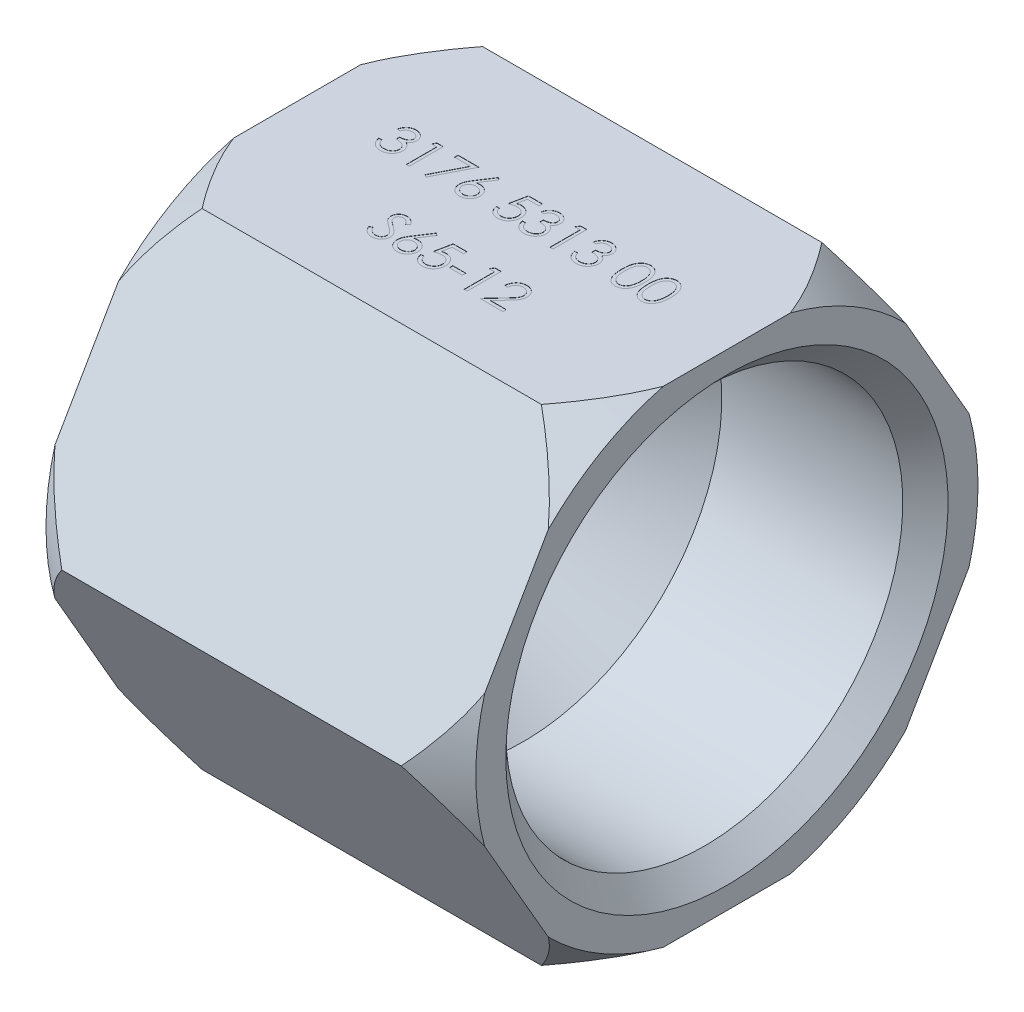
from build123d import *

# Parameters (mm, degrees)
SKETCH2_OUTSIDE_W  = 34.778
SKETCH2_OUTSIDE_H  = 34.778
EXTRUDE1_DEPTH     = 19
CHAMFER1_SIZE      = 1
SKETCH3_W          = 0.576923077
SKETCH3_H          = 0.153846154
CUT_EXTRUDE1_DEPTH = 0.01


with BuildPart() as part:
    # Sketch1 → Revolve1 (revolve)
    with BuildSketch(Plane.XY, mode=Mode.PRIVATE) as revolve1_sk:
        Polygon((0, 0), (0, 11.1), (2, 12.4), (17, 12.4), (19, 11.1), (19, 8.775), (10, 8.775), (3, 3.500121649), (3, 0), align=None)
    revolve(revolve1_sk.sketch.rotate(Axis((0, 0, 0), (1, 0, 0)), 90), axis=Axis((0, 0, 0), (1, 0, 0)))

    # Sketch2 outside → Extrude1 (cut)
    with BuildSketch(Plane(origin=(19, 0, 0), x_dir=(0, 0, -1), z_dir=(1, 0, 0))):
        Rectangle(SKETCH2_OUTSIDE_W, SKETCH2_OUTSIDE_H)
        Polygon((6.2, 10.738715007), (-6.2, 10.738715007), (-12.4, 0), (-6.2, -10.738715007), (6.2, -10.738715007), (12.4, 0), align=None, mode=Mode.SUBTRACT)
    extrude(amount=-EXTRUDE1_DEPTH, mode=Mode.SUBTRACT)

    # Chamfer1
    chamfer1_edges = [part.edges().sort_by_distance(p)[0] for p in [
        (19, 0, -8.775),
    ]]
    chamfer(chamfer1_edges, length=CHAMFER1_SIZE)

    # Sketch3 → Cut-Extrude1 (cut)
    # profile 1 of 16: a face of its own
    with BuildSketch(Plane(origin=(0, 10.738715007, 0), x_dir=(1, 0, 0), z_dir=(0, 1, 0))):
        with BuildLine():
            Line((3.403846154, 1.153846154), (3.269230769, 1.153846154))
            add(Edge.make_bspline(
                [(3.269230769, 1.153846154), (3.27287772, 1.16894579), (3.280007209, 1.198464343), (3.294877598, 1.240638884), (3.311077278, 1.280548964), (3.330529752, 1.317447281), (3.351747789, 1.352075383), (3.376057527, 1.383647864), (3.402337408, 1.412967707), (3.431405244, 1.438987666), (3.461888956, 1.46254955), (3.494218079, 1.48263886), (3.527742176, 1.49992064), (3.562693519, 1.514157882), (3.599176164, 1.524883106), (3.636860288, 1.532664595), (3.675844645, 1.537717929), (3.702307898, 1.538211113), (3.715745192, 1.538461538)],
                knots=[0, 0, 0, 0, 1.162005537, 2.271625781, 3.343758855, 4.383309926, 5.390229558, 6.379919256, 7.361854164, 8.333198761, 9.295911338, 10.242430842, 11.177959212, 12.116337295, 13.062827104, 14.020064771, 14.994644689, 16, 16, 16, 16], degree=3))
            add(Edge.make_bspline(
                [(3.715745192, 1.538461538), (3.73532351, 1.53787044), (3.774053086, 1.536701136), (3.830951535, 1.52602352), (3.885820172, 1.509127035), (3.938058421, 1.485781152), (3.986580606, 1.456986589), (4.029753258, 1.422715988), (4.066991191, 1.383630573), (4.098231639, 1.340459474), (4.122692352, 1.294321398), (4.14072937, 1.246835617), (4.15171009, 1.198114772), (4.153133186, 1.165218795), (4.153846154, 1.148737981)],
                knots=[0, 0, 0, 0, 1.083050992, 2.142477498, 3.193116406, 4.255571735, 5.30263384, 6.308962982, 7.297363603, 8.282367274, 9.249857812, 10.179914175, 11.08814088, 12, 12, 12, 12], degree=3))
            add(Edge.make_bspline(
                [(4.153846154, 1.148737981), (4.153347472, 1.132877926), (4.152371629, 1.10184226), (4.144085755, 1.056533047), (4.130141642, 1.013829504), (4.11082603, 0.973551863), (4.085822508, 0.935955503), (4.05553421, 0.900955835), (4.019747355, 0.868397625), (3.99262781, 0.849746422), (3.978665865, 0.840144231)],
                knots=[0, 0, 0, 0, 1.024540389, 2.004866551, 2.965041327, 3.920577974, 4.882998113, 5.874504559, 6.905732034, 8, 8, 8, 8], degree=3))
            add(Edge.make_bspline(
                [(3.978665865, 0.840144231), (3.994622332, 0.8324393), (4.026236706, 0.817173604), (4.06932979, 0.787235422), (4.10844888, 0.752668416), (4.130264759, 0.725692994), (4.141225962, 0.712139423)],
                knots=[0, 0, 0, 0, 1.015518401, 2.012035669, 3.001164323, 4, 4, 4, 4], degree=3))
            add(Edge.make_bspline(
                [(4.141225962, 0.712139423), (4.14844368, 0.70225753), (4.162760921, 0.682655565), (4.180433292, 0.651139954), (4.19646577, 0.61927503), (4.208958721, 0.586206713), (4.218633236, 0.552318279), (4.225548678, 0.517551538), (4.229844738, 0.4818781), (4.230459975, 0.457744179), (4.230769231, 0.445612981)],
                knots=[0, 0, 0, 0, 1.025084078, 2.033381695, 3.024893161, 4.013698104, 4.991890475, 5.976764909, 6.982997093, 8, 8, 8, 8], degree=3))
            add(Edge.make_bspline(
                [(4.230769231, 0.445612981), (4.230000154, 0.424608815), (4.228465618, 0.382699328), (4.214749587, 0.32078159), (4.193486769, 0.260256375), (4.163290939, 0.202367158), (4.126490578, 0.148204138), (4.082708868, 0.099742862), (4.032443265, 0.058086318), (3.976383701, 0.023281934), (3.915647789, -0.004540032), (3.850686821, -0.023850365), (3.782436797, -0.036427222), (3.73563367, -0.03777588), (3.711838942, -0.038461538)],
                knots=[0, 0, 0, 0, 0.955779014, 1.907060117, 2.875433937, 3.871313158, 4.872415639, 5.851225146, 6.836215519, 7.83643374, 8.849228613, 9.86973379, 10.916971861, 12, 12, 12, 12], degree=3))
            add(Edge.make_bspline(
                [(3.711838942, -0.038461538), (3.695802099, -0.038089447), (3.66424694, -0.037357295), (3.617856869, -0.03235218), (3.573576141, -0.02321075), (3.531344885, -0.010909333), (3.491125583, 0.004687128), (3.453040967, 0.024109427), (3.416856727, 0.046957214), (3.382914319, 0.07350018), (3.35121779, 0.103192183), (3.32260948, 0.13656033), (3.296612426, 0.172987788), (3.273922723, 0.21289767), (3.253506887, 0.255774209), (3.236715048, 0.302166422), (3.221935519, 0.351659574), (3.215064034, 0.386150034), (3.211538462, 0.403846154)],
                knots=[0, 0, 0, 0, 1.048658725, 2.063410685, 3.046034179, 4.001477787, 4.936774919, 5.862367409, 6.792675028, 7.730719943, 8.675894397, 9.627829632, 10.600096036, 11.597688215, 12.626045268, 13.701542398, 14.82072376, 16, 16, 16, 16], degree=3))
            Line((3.211538462, 0.403846154), (3.346153846, 0.403846154))
            add(Edge.make_bspline(
                [(3.346153846, 0.403846154), (3.349660971, 0.392296577), (3.356482634, 0.369831646), (3.368094476, 0.337500086), (3.381323735, 0.307860921), (3.395515689, 0.280696726), (3.410420737, 0.255739982), (3.427098562, 0.233650609), (3.44431391, 0.21345838), (3.457290776, 0.202082118), (3.463641827, 0.196514423)],
                knots=[0, 0, 0, 0, 1.198163088, 2.33053128, 3.407730985, 4.417276592, 5.372219308, 6.28897303, 7.162600585, 8, 8, 8, 8], degree=3))
            add(Edge.make_bspline(
                [(3.463641827, 0.196514423), (3.47204036, 0.190039423), (3.488811501, 0.177109409), (3.516140743, 0.160608711), (3.544882837, 0.146311129), (3.575660554, 0.135389545), (3.607809742, 0.126141976), (3.641850041, 0.120090325), (3.677481134, 0.115938252), (3.701810176, 0.115571852), (3.714242788, 0.115384615)],
                knots=[0, 0, 0, 0, 0.946170439, 1.889420265, 2.845303464, 3.807233317, 4.801018734, 5.828864929, 6.890507805, 8, 8, 8, 8], degree=3))
            add(Edge.make_bspline(
                [(3.714242788, 0.115384615), (3.728280004, 0.115648575), (3.755728567, 0.116164725), (3.795780649, 0.120911456), (3.833883841, 0.12782449), (3.869615095, 0.138501483), (3.903442455, 0.151693277), (3.934891734, 0.168256879), (3.964375779, 0.187690331), (3.991516953, 0.209778542), (4.015922171, 0.233959183), (4.037410533, 0.259250499), (4.055678245, 0.285545854), (4.070414065, 0.312990763), (4.082050015, 0.341471576), (4.089971387, 0.371068217), (4.095479179, 0.401538474), (4.095927727, 0.422250889), (4.096153846, 0.432692308)],
                knots=[0, 0, 0, 0, 1.217147791, 2.380027433, 3.494444702, 4.572153297, 5.609568379, 6.639424714, 7.649109417, 8.668170816, 9.669597737, 10.625200337, 11.543417969, 12.441394052, 13.322311151, 14.205496177, 15.095365482, 16, 16, 16, 16], degree=3))
            add(Edge.make_bspline(
                [(4.096153846, 0.432692308), (4.095498003, 0.446668596), (4.094189579, 0.474551628), (4.084200188, 0.515573445), (4.067769246, 0.555097765), (4.044766741, 0.592450247), (4.016765715, 0.62706849), (3.984037897, 0.657956268), (3.946311514, 0.68344345), (3.911588713, 0.701052874), (3.880832217, 0.713068764), (3.854511338, 0.72107232), (3.825044222, 0.727849601), (3.792787216, 0.73415486), (3.757497266, 0.739521152), (3.719212792, 0.743996216), (3.677926037, 0.747576948), (3.649344109, 0.749175989), (3.634615385, 0.75)],
                knots=[0, 0, 0, 0, 1.07054697, 2.135767047, 3.216561865, 4.33974944, 5.486079747, 6.621378074, 7.775625952, 8.963672916, 9.598146892, 10.304877434, 11.070270905, 11.915000392, 12.823868403, 13.805723172, 14.86925407, 16, 16, 16, 16], degree=3))
            Line((3.634615385, 0.75), (3.634615385, 0.903846154))
            add(Edge.make_bspline(
                [(3.634615385, 0.903846154), (3.653173027, 0.90416107), (3.68952289, 0.904777913), (3.742620449, 0.912238488), (3.793394726, 0.922558758), (3.840720472, 0.938366697), (3.883855635, 0.956726824), (3.921278322, 0.978092057), (3.952464242, 1.001841235), (3.977261844, 1.028340925), (3.995917228, 1.05676166), (4.009557284, 1.086383084), (4.017614566, 1.117464825), (4.018690138, 1.138676825), (4.019230769, 1.149338942)],
                knots=[0, 0, 0, 0, 1.321986639, 2.589447074, 3.816329219, 5.01088745, 6.139805852, 7.153945165, 8.075214402, 8.924034688, 9.728124013, 10.488707548, 11.240355623, 12, 12, 12, 12], degree=3))
            add(Edge.make_bspline(
                [(4.019230769, 1.149338942), (4.019053165, 1.157172262), (4.018699828, 1.172756279), (4.014243852, 1.195524166), (4.007547835, 1.217596), (3.998342236, 1.238877918), (3.986020723, 1.259222321), (3.9712753, 1.278802657), (3.953717543, 1.297507133), (3.933598065, 1.314941556), (3.911993006, 1.331556943), (3.888314531, 1.345662788), (3.863276585, 1.357724957), (3.836851447, 1.367671887), (3.808953362, 1.375154439), (3.779713409, 1.380526942), (3.749075831, 1.383885937), (3.72817366, 1.384369544), (3.717548077, 1.384615385)],
                knots=[0, 0, 0, 0, 0.884392785, 1.759457502, 2.611959086, 3.489218968, 4.37281399, 5.2945488, 6.255912374, 7.266815255, 8.301784654, 9.332968512, 10.37626691, 11.440494194, 12.520033166, 13.637162961, 14.798855837, 16, 16, 16, 16], degree=3))
            add(Edge.make_bspline(
                [(3.717548077, 1.384615385), (3.700468791, 1.384019087), (3.667108972, 1.382854378), (3.619016865, 1.372653086), (3.574308579, 1.356376765), (3.540134865, 1.336948328), (3.514899476, 1.317769571), (3.496866502, 1.301019977), (3.479157712, 1.282405909), (3.462938136, 1.260780891), (3.446535003, 1.23760941), (3.43160162, 1.211713546), (3.417090323, 1.183768806), (3.408346373, 1.164013534), (3.403846154, 1.153846154)],
                knots=[0, 0, 0, 0, 1.472543308, 2.876219568, 4.221790263, 5.565193594, 6.249813518, 6.953379497, 7.687249741, 8.463570142, 9.283606569, 10.136032583, 11.040678096, 12, 12, 12, 12], degree=3))
        make_face()
    # profile 2 of 16: a face of its own
    with BuildSketch(Plane(origin=(0, 10.738715007, 0), x_dir=(1, 0, 0), z_dir=(0, 1, 0))):
        Polygon((4.684194712, 1.5), (4.961538462, 1.5), (4.961538462, 0), (4.826923077, 0), (4.826923077, 1.346153846), (4.596153846, 1.346153846), align=None)
    # profile 3 of 16: a face of its own
    with BuildSketch(Plane(origin=(0, 10.738715007, 0), x_dir=(1, 0, 0), z_dir=(0, 1, 0))):
        Polygon((5.615384615, 1.5), (6.538461538, 1.5), (5.75, -0.038461538), (5.633713942, 0.025540865), (6.310697115, 1.346153846), (5.615384615, 1.346153846), align=None)
    # profile 4 of 16: a face of its own
    with BuildSketch(Plane(origin=(0, 10.738715007, 0), x_dir=(1, 0, 0), z_dir=(0, 1, 0))):
        with BuildLine():
            Line((7.365384615, 1.538461538), (7.469050481, 1.45703125))
            Line((7.469050481, 1.45703125), (7.072716346, 0.850961538))
            add(Edge.make_bspline(
                [(7.072716346, 0.850961538), (7.099103608, 0.855167479), (7.150574945, 0.863371641), (7.202674616, 0.864725046), (7.228064904, 0.865384615)],
                knots=[0, 0, 0, 0, 1.025318673, 2, 2, 2, 2], degree=3))
            add(Edge.make_bspline(
                [(7.228064904, 0.865384615), (7.243310259, 0.864974853), (7.273320288, 0.864168249), (7.317380346, 0.857960884), (7.359718462, 0.848178693), (7.400159153, 0.833919155), (7.438847573, 0.81570386), (7.476005743, 0.793872916), (7.510935176, 0.767299053), (7.544085681, 0.737614072), (7.574183009, 0.704735364), (7.60082989, 0.669849077), (7.623212801, 0.632991557), (7.641373053, 0.594181471), (7.655475144, 0.553478646), (7.665755563, 0.510935157), (7.671832531, 0.466521669), (7.672657742, 0.436316737), (7.673076923, 0.420973558)],
                knots=[0, 0, 0, 0, 1.04369286, 2.054478336, 3.041073146, 4.015093852, 4.984733326, 5.965804835, 6.960378782, 7.985147595, 9.009457201, 10.008161701, 10.986880575, 11.956520048, 12.937015923, 13.931873656, 14.949455224, 16, 16, 16, 16], degree=3))
            add(Edge.make_bspline(
                [(7.673076923, 0.420973558), (7.672467021, 0.399982256), (7.671266878, 0.358676342), (7.659308108, 0.298514896), (7.640725403, 0.241200961), (7.614163605, 0.187649602), (7.581171156, 0.137934215), (7.540937902, 0.093883301), (7.494890692, 0.054596142), (7.442824922, 0.021743306), (7.386792223, -0.005086573), (7.327927081, -0.024357391), (7.266801161, -0.036221735), (7.225313472, -0.037709137), (7.204326923, -0.038461538)],
                knots=[0, 0, 0, 0, 1.031375318, 2.029502543, 3.004789286, 3.987476834, 4.960371455, 5.9300674, 6.912260825, 7.929083631, 8.949397511, 9.960523116, 10.96833055, 12, 12, 12, 12], degree=3))
            add(Edge.make_bspline(
                [(7.204326923, -0.038461538), (7.184142623, -0.037806593), (7.144161058, -0.036509261), (7.085347003, -0.024952431), (7.028834282, -0.006220815), (6.975018833, 0.019585304), (6.925167141, 0.05218154), (6.880567583, 0.091422517), (6.841442537, 0.13646943), (6.808881985, 0.187315293), (6.783056814, 0.241953846), (6.763689703, 0.298926914), (6.752377028, 0.358026906), (6.750796217, 0.398090251), (6.75, 0.418269231)],
                knots=[0, 0, 0, 0, 1.012016664, 2.004627821, 2.994792927, 3.992885782, 4.990978636, 5.973936114, 6.964471063, 7.975201453, 8.993600317, 9.990122807, 10.98767138, 12, 12, 12, 12], degree=3))
            add(Edge.make_bspline(
                [(6.75, 0.418269231), (6.750506334, 0.433716909), (6.75154017, 0.465258117), (6.758758766, 0.513028415), (6.770357964, 0.56190745), (6.783348069, 0.603373533), (6.797073331, 0.637342757), (6.808495848, 0.664729967), (6.822713274, 0.692913284), (6.837873295, 0.722859128), (6.855340525, 0.753795742), (6.874332946, 0.786240172), (6.895375653, 0.819676427), (6.910127152, 0.842366796), (6.917668269, 0.853966346)],
                knots=[0, 0, 0, 0, 1.173818275, 2.396712641, 3.66331629, 4.989737886, 5.693666774, 6.447286557, 7.243889047, 8.091586357, 8.998013824, 9.943181721, 10.948533338, 12, 12, 12, 12], degree=3))
            Line((6.917668269, 0.853966346), (7.365384615, 1.538461538))
        make_face()
        with BuildLine():
            add(Edge.make_bspline(
                [(7.199819712, 0.711538462), (7.188393035, 0.711205014), (7.166073417, 0.710553695), (7.133327382, 0.706771444), (7.102335989, 0.699648987), (7.072688646, 0.690577702), (7.04493963, 0.678104962), (7.01888727, 0.662954191), (6.994430819, 0.645116544), (6.97182644, 0.624844725), (6.951332298, 0.602649853), (6.933683242, 0.578877201), (6.918459357, 0.554099685), (6.906081434, 0.528110281), (6.89644283, 0.500918924), (6.889470723, 0.472650675), (6.885590544, 0.443115972), (6.884945016, 0.423087757), (6.884615385, 0.412860577)],
                knots=[0, 0, 0, 0, 1.129588631, 2.206414736, 3.251139165, 4.268635594, 5.265702196, 6.250456724, 7.242448911, 8.251968645, 9.246821453, 10.222880186, 11.173611482, 12.116736599, 13.062300278, 14.020270554, 14.989073742, 16, 16, 16, 16], degree=3))
            add(Edge.make_bspline(
                [(6.884615385, 0.412860577), (6.884883825, 0.402724871), (6.885410197, 0.382850261), (6.890189763, 0.353562042), (6.897490513, 0.325377081), (6.908350682, 0.298440681), (6.921305063, 0.272342259), (6.938407345, 0.248027137), (6.957357396, 0.224018536), (6.980009082, 0.202160762), (7.004319094, 0.181822209), (7.030291038, 0.164044957), (7.057359592, 0.148836597), (7.085890202, 0.136917555), (7.115478081, 0.127135718), (7.146369747, 0.120252227), (7.178586685, 0.116360573), (7.200410373, 0.115714204), (7.211538462, 0.115384615)],
                knots=[0, 0, 0, 0, 0.989467248, 1.94019797, 2.891935182, 3.827694429, 4.772920941, 5.730924762, 6.725747692, 7.756678648, 8.79901574, 9.819492441, 10.826891316, 11.826466727, 12.835195252, 13.867842842, 14.912794438, 16, 16, 16, 16], degree=3))
            add(Edge.make_bspline(
                [(7.211538462, 0.115384615), (7.222666532, 0.11571423), (7.244490184, 0.11636065), (7.276707382, 0.120251936), (7.30759809, 0.127136785), (7.33718945, 0.136913687), (7.365707207, 0.148850948), (7.392752087, 0.163950342), (7.418478413, 0.181931536), (7.442804384, 0.202126005), (7.465361786, 0.224142941), (7.484766334, 0.247812823), (7.501344863, 0.272538778), (7.514816657, 0.298337873), (7.525557211, 0.325393368), (7.532894983, 0.353557678), (7.537664678, 0.382851404), (7.538192406, 0.402725257), (7.538461538, 0.412860577)],
                knots=[0, 0, 0, 0, 1.087397944, 2.132534446, 3.165364764, 4.174271784, 5.174024072, 6.181601208, 7.194203697, 8.236725232, 9.267838612, 10.269026844, 11.221737037, 12.171628256, 13.107553087, 14.05945871, 15.010357665, 16, 16, 16, 16], degree=3))
            add(Edge.make_bspline(
                [(7.538461538, 0.412860577), (7.538225699, 0.423101099), (7.537762822, 0.443199913), (7.532527415, 0.472637463), (7.525266398, 0.501062552), (7.514302242, 0.52829653), (7.500058008, 0.554231927), (7.482707977, 0.578999756), (7.462636875, 0.602789905), (7.439452215, 0.624888252), (7.414213544, 0.645094142), (7.387378293, 0.662931095), (7.359303447, 0.677984656), (7.330017472, 0.690544843), (7.299184808, 0.699608903), (7.267303234, 0.706746007), (7.233964987, 0.710544015), (7.21134644, 0.711202757), (7.199819712, 0.711538462)],
                knots=[0, 0, 0, 0, 0.978206639, 1.919901502, 2.851605144, 3.780102724, 4.718870031, 5.675451981, 6.667674623, 7.690630536, 8.733308323, 9.756129687, 10.767539656, 11.776269907, 12.797430371, 13.836405707, 14.897401972, 16, 16, 16, 16], degree=3))
        make_face(mode=Mode.SUBTRACT)
    # profile 5 of 16: a face of its own
    with BuildSketch(Plane(origin=(0, 10.738715007, 0), x_dir=(1, 0, 0), z_dir=(0, 1, 0))):
        with BuildLine():
            Line((9.346153846, 1.5), (9.346153846, 1.346153846))
            Line((9.346153846, 1.346153846), (8.8359375, 1.346153846))
            Line((8.8359375, 1.346153846), (8.755108173, 0.951622596))
            add(Edge.make_bspline(
                [(8.755108173, 0.951622596), (8.770989262, 0.956006998), (8.80175636, 0.964501084), (8.847167729, 0.973932129), (8.890278674, 0.979617319), (8.918253832, 0.980393595), (8.931790865, 0.980769231)],
                knots=[0, 0, 0, 0, 1.100273476, 2.13160584, 3.095893838, 4, 4, 4, 4], degree=3))
            add(Edge.make_bspline(
                [(8.931790865, 0.980769231), (8.94854104, 0.980406687), (8.981476067, 0.979693835), (9.029664187, 0.972848757), (9.075663998, 0.962074508), (9.1193793, 0.947022855), (9.160890965, 0.927775827), (9.199817062, 0.903732995), (9.236741882, 0.875647282), (9.271002994, 0.843356563), (9.30208484, 0.807818727), (9.329413122, 0.769608211), (9.35262566, 0.729096355), (9.371294555, 0.685896095), (9.386202127, 0.640485029), (9.396124411, 0.592385351), (9.402731571, 0.542050442), (9.403469737, 0.507634198), (9.403846154, 0.490084135)],
                knots=[0, 0, 0, 0, 1.052922333, 2.070308379, 3.05430497, 4.020497103, 4.973039431, 5.925935799, 6.892292201, 7.88610001, 8.88166317, 9.857072816, 10.836096531, 11.812156883, 12.81219415, 13.836441305, 14.89672472, 16, 16, 16, 16], degree=3))
            add(Edge.make_bspline(
                [(9.403846154, 0.490084135), (9.403561122, 0.477860326), (9.402994909, 0.453577903), (9.400115514, 0.417516102), (9.394571636, 0.382217745), (9.387128326, 0.347678149), (9.377467289, 0.313962704), (9.365771981, 0.280974906), (9.351459397, 0.248920074), (9.335760237, 0.217494905), (9.318083175, 0.187409831), (9.298463814, 0.159274551), (9.277735747, 0.132667001), (9.255432296, 0.107872544), (9.231346155, 0.085054108), (9.205769026, 0.064076273), (9.178905004, 0.044584275), (9.150338471, 0.027369334), (9.120705979, 0.011528067), (9.0895796, -0.001467735), (9.057667871, -0.013086533), (9.024511496, -0.022347759), (8.990185576, -0.029604568), (8.95463353, -0.034533397), (8.918041814, -0.038123298), (8.893238237, -0.038348023), (8.880709135, -0.038461538)],
                knots=[0, 0, 0, 0, 1.056347294, 2.098418968, 3.122841568, 4.141288669, 5.149314143, 6.15115421, 7.162517403, 8.180376062, 9.185164535, 10.17417709, 11.141909838, 12.097768115, 13.052685741, 14.0056014, 14.954263652, 15.917497458, 16.885230207, 17.854509472, 18.828990115, 19.81800267, 20.826176721, 21.857883937, 22.917946725, 24, 24, 24, 24], degree=3))
            add(Edge.make_bspline(
                [(8.880709135, -0.038461538), (8.865763057, -0.038165465), (8.836358415, -0.037582976), (8.793278172, -0.031489339), (8.751829056, -0.022761946), (8.712344727, -0.009632116), (8.674471328, 0.006819581), (8.638718735, 0.027612226), (8.604173402, 0.051174699), (8.572239672, 0.078980565), (8.542601338, 0.109373), (8.516069977, 0.142354846), (8.492441301, 0.17738175), (8.472093695, 0.214623816), (8.4547374, 0.253983186), (8.441102405, 0.29560733), (8.430097396, 0.33927876), (8.425441644, 0.36934455), (8.423076923, 0.384615385)],
                knots=[0, 0, 0, 0, 1.0467383, 2.05933395, 3.04377827, 4.011590433, 4.970194871, 5.932262533, 6.905835911, 7.896367577, 8.894135286, 9.877477877, 10.858688626, 11.851381753, 12.8477658, 13.868841284, 14.917554742, 16, 16, 16, 16], degree=3))
            Line((8.423076923, 0.384615385), (8.557692308, 0.384615385))
            add(Edge.make_bspline(
                [(8.557692308, 0.384615385), (8.561004547, 0.370311191), (8.567370854, 0.342817736), (8.581344746, 0.304190018), (8.598430121, 0.269767494), (8.61874627, 0.239094815), (8.642981998, 0.212348102), (8.670637467, 0.188512218), (8.701643634, 0.167008591), (8.736097876, 0.149084548), (8.772446338, 0.13379794), (8.810489428, 0.123618642), (8.849191291, 0.116461116), (8.875367735, 0.115744647), (8.888521635, 0.115384615)],
                knots=[0, 0, 0, 0, 1.136247022, 2.183929868, 3.172523383, 4.106158343, 5.02341133, 5.958108904, 6.928429099, 7.938127109, 8.96079061, 9.975095812, 10.982467395, 12, 12, 12, 12], degree=3))
            add(Edge.make_bspline(
                [(8.888521635, 0.115384615), (8.901360968, 0.115736377), (8.92664172, 0.116429), (8.9638466, 0.121760005), (8.999766404, 0.129970392), (9.034046699, 0.142257473), (9.067287359, 0.157190924), (9.098647546, 0.176354528), (9.129034494, 0.198408821), (9.157503694, 0.223675949), (9.183577744, 0.251520103), (9.206616081, 0.281296129), (9.225806187, 0.313060492), (9.241977948, 0.346263272), (9.254257933, 0.381268368), (9.263018354, 0.417911728), (9.268162522, 0.456283863), (9.26887017, 0.482456424), (9.269230769, 0.495793269)],
                knots=[0, 0, 0, 0, 1.027316725, 2.022795036, 3.002884548, 3.971462791, 4.93288096, 5.914575861, 6.907176829, 7.935150275, 8.956128384, 9.956726525, 10.942570165, 11.921478529, 12.907843606, 13.90538589, 14.932640048, 16, 16, 16, 16], degree=3))
            add(Edge.make_bspline(
                [(9.269230769, 0.495793269), (9.268948564, 0.507825734), (9.268396187, 0.531377572), (9.263883085, 0.565834375), (9.256032954, 0.598437108), (9.245137006, 0.629343208), (9.231302931, 0.658581826), (9.214397368, 0.686183137), (9.194103055, 0.711783352), (9.170920817, 0.735394446), (9.145524514, 0.757185107), (9.117477195, 0.775761144), (9.087365798, 0.791388537), (9.055553113, 0.804874822), (9.021282442, 0.814560856), (8.985232457, 0.821832807), (8.947013868, 0.826039391), (8.920883573, 0.826623057), (8.907451923, 0.826923077)],
                knots=[0, 0, 0, 0, 1.045622112, 2.046656509, 3.013763289, 3.955457236, 4.890082067, 5.820317437, 6.762574623, 7.722996705, 8.69280354, 9.665887285, 10.63943826, 11.638615906, 12.663482002, 13.728887084, 14.832589034, 16, 16, 16, 16], degree=3))
            add(Edge.make_bspline(
                [(8.907451923, 0.826923077), (8.895825239, 0.826674252), (8.871819087, 0.826160492), (8.834995018, 0.822377708), (8.796298566, 0.816275153), (8.755878068, 0.807881047), (8.713612136, 0.7968963), (8.669589964, 0.783732942), (8.623718992, 0.767994943), (8.592811396, 0.756109708), (8.576923077, 0.75)],
                knots=[0, 0, 0, 0, 0.817624296, 1.688186739, 2.600797293, 3.572016777, 4.590301741, 5.671205678, 6.80286297, 8, 8, 8, 8], degree=3))
            Line((8.576923077, 0.75), (8.730769231, 1.5))
            Line((8.730769231, 1.5), (9.346153846, 1.5))
        make_face()
    # profile 6 of 16: a face of its own
    with BuildSketch(Plane(origin=(0, 10.738715007, 0), x_dir=(1, 0, 0), z_dir=(0, 1, 0))):
        with BuildLine():
            Line((9.75, 1.153846154), (9.615384615, 1.153846154))
            add(Edge.make_bspline(
                [(9.615384615, 1.153846154), (9.619031566, 1.16894579), (9.626161055, 1.198464343), (9.641031444, 1.240638884), (9.657231125, 1.280548964), (9.676683598, 1.317447281), (9.697901636, 1.352075383), (9.722211373, 1.383647864), (9.748491254, 1.412967707), (9.77755909, 1.438987666), (9.808042802, 1.46254955), (9.840371925, 1.48263886), (9.873896022, 1.49992064), (9.908847365, 1.514157882), (9.94533001, 1.524883106), (9.983014134, 1.532664595), (10.021998491, 1.537717929), (10.048461744, 1.538211113), (10.061899038, 1.538461538)],
                knots=[0, 0, 0, 0, 1.162005537, 2.271625781, 3.343758855, 4.383309926, 5.390229558, 6.379919256, 7.361854164, 8.333198761, 9.295911338, 10.242430842, 11.177959212, 12.116337295, 13.062827104, 14.020064771, 14.994644689, 16, 16, 16, 16], degree=3))
            add(Edge.make_bspline(
                [(10.061899038, 1.538461538), (10.081477356, 1.53787044), (10.120206933, 1.536701136), (10.177105381, 1.52602352), (10.231974018, 1.509127035), (10.284212267, 1.485781152), (10.332734453, 1.456986589), (10.375907104, 1.422715988), (10.413145037, 1.383630573), (10.444385485, 1.340459474), (10.468846199, 1.294321398), (10.486883216, 1.246835617), (10.497863936, 1.198114772), (10.499287032, 1.165218795), (10.5, 1.148737981)],
                knots=[0, 0, 0, 0, 1.083050992, 2.142477498, 3.193116406, 4.255571735, 5.30263384, 6.308962982, 7.297363603, 8.282367274, 9.249857812, 10.179914175, 11.08814088, 12, 12, 12, 12], degree=3))
            add(Edge.make_bspline(
                [(10.5, 1.148737981), (10.499501318, 1.132877926), (10.498525475, 1.10184226), (10.490239601, 1.056533047), (10.476295489, 1.013829504), (10.456979876, 0.973551863), (10.431976355, 0.935955503), (10.401688056, 0.900955835), (10.365901201, 0.868397625), (10.338781656, 0.849746422), (10.324819712, 0.840144231)],
                knots=[0, 0, 0, 0, 1.024540389, 2.004866551, 2.965041327, 3.920577974, 4.882998113, 5.874504559, 6.905732034, 8, 8, 8, 8], degree=3))
            add(Edge.make_bspline(
                [(10.324819712, 0.840144231), (10.340776178, 0.8324393), (10.372390552, 0.817173604), (10.415483637, 0.787235422), (10.454602726, 0.752668416), (10.476418606, 0.725692994), (10.487379808, 0.712139423)],
                knots=[0, 0, 0, 0, 1.015518401, 2.012035669, 3.001164323, 4, 4, 4, 4], degree=3))
            add(Edge.make_bspline(
                [(10.487379808, 0.712139423), (10.494597526, 0.70225753), (10.508914767, 0.682655565), (10.526587139, 0.651139954), (10.542619616, 0.61927503), (10.555112567, 0.586206713), (10.564787082, 0.552318279), (10.571702524, 0.517551538), (10.575998584, 0.4818781), (10.576613821, 0.457744179), (10.576923077, 0.445612981)],
                knots=[0, 0, 0, 0, 1.025084078, 2.033381695, 3.024893161, 4.013698104, 4.991890475, 5.976764909, 6.982997093, 8, 8, 8, 8], degree=3))
            add(Edge.make_bspline(
                [(10.576923077, 0.445612981), (10.576154, 0.424608815), (10.574619465, 0.382699328), (10.560903433, 0.32078159), (10.539640615, 0.260256375), (10.509444786, 0.202367158), (10.472644425, 0.148204138), (10.428862714, 0.099742862), (10.378597111, 0.058086318), (10.322537547, 0.023281934), (10.261801635, -0.004540032), (10.196840667, -0.023850365), (10.128590644, -0.036427222), (10.081787516, -0.03777588), (10.057992788, -0.038461538)],
                knots=[0, 0, 0, 0, 0.955779014, 1.907060117, 2.875433937, 3.871313158, 4.872415639, 5.851225146, 6.836215519, 7.83643374, 8.849228613, 9.86973379, 10.916971861, 12, 12, 12, 12], degree=3))
            add(Edge.make_bspline(
                [(10.057992788, -0.038461538), (10.041955945, -0.038089447), (10.010400786, -0.037357295), (9.964010715, -0.03235218), (9.919729987, -0.02321075), (9.877498731, -0.010909333), (9.83727943, 0.004687128), (9.799194813, 0.024109427), (9.763010573, 0.046957214), (9.729068165, 0.07350018), (9.697371636, 0.103192183), (9.668763326, 0.13656033), (9.642766272, 0.172987788), (9.62007657, 0.21289767), (9.599660733, 0.255774209), (9.582868894, 0.302166422), (9.568089365, 0.351659574), (9.56121788, 0.386150034), (9.557692308, 0.403846154)],
                knots=[0, 0, 0, 0, 1.048658725, 2.063410685, 3.046034179, 4.001477787, 4.936774919, 5.862367409, 6.792675028, 7.730719943, 8.675894397, 9.627829632, 10.600096036, 11.597688215, 12.626045268, 13.701542398, 14.82072376, 16, 16, 16, 16], degree=3))
            Line((9.557692308, 0.403846154), (9.692307692, 0.403846154))
            add(Edge.make_bspline(
                [(9.692307692, 0.403846154), (9.695814817, 0.392296577), (9.70263648, 0.369831646), (9.714248322, 0.337500086), (9.727477581, 0.307860921), (9.741669535, 0.280696726), (9.756574583, 0.255739982), (9.773252408, 0.233650609), (9.790467756, 0.21345838), (9.803444622, 0.202082118), (9.809795673, 0.196514423)],
                knots=[0, 0, 0, 0, 1.198163088, 2.33053128, 3.407730985, 4.417276592, 5.372219308, 6.28897303, 7.162600585, 8, 8, 8, 8], degree=3))
            add(Edge.make_bspline(
                [(9.809795673, 0.196514423), (9.818194206, 0.190039423), (9.834965347, 0.177109409), (9.862294589, 0.160608711), (9.891036683, 0.146311129), (9.921814401, 0.135389545), (9.953963588, 0.126141976), (9.988003887, 0.120090325), (10.02363498, 0.115938252), (10.047964022, 0.115571852), (10.060396635, 0.115384615)],
                knots=[0, 0, 0, 0, 0.946170439, 1.889420265, 2.845303464, 3.807233317, 4.801018734, 5.828864929, 6.890507805, 8, 8, 8, 8], degree=3))
            add(Edge.make_bspline(
                [(10.060396635, 0.115384615), (10.07443385, 0.115648575), (10.101882413, 0.116164725), (10.141934496, 0.120911456), (10.180037687, 0.12782449), (10.215768941, 0.138501483), (10.249596302, 0.151693277), (10.28104558, 0.168256879), (10.310529626, 0.187690331), (10.337670799, 0.209778542), (10.362076017, 0.233959183), (10.38356438, 0.259250499), (10.401832092, 0.285545854), (10.416567911, 0.312990763), (10.428203861, 0.341471576), (10.436125233, 0.371068217), (10.441633025, 0.401538474), (10.442081573, 0.422250889), (10.442307692, 0.432692308)],
                knots=[0, 0, 0, 0, 1.217147791, 2.380027433, 3.494444702, 4.572153297, 5.609568379, 6.639424714, 7.649109417, 8.668170816, 9.669597737, 10.625200337, 11.543417969, 12.441394052, 13.322311151, 14.205496177, 15.095365482, 16, 16, 16, 16], degree=3))
            add(Edge.make_bspline(
                [(10.442307692, 0.432692308), (10.441651849, 0.446668596), (10.440343425, 0.474551628), (10.430354034, 0.515573445), (10.413923092, 0.555097765), (10.390920587, 0.592450247), (10.362919561, 0.62706849), (10.330191744, 0.657956268), (10.29246536, 0.68344345), (10.257742559, 0.701052874), (10.226986063, 0.713068764), (10.200665184, 0.72107232), (10.171198069, 0.727849601), (10.138941062, 0.73415486), (10.103651112, 0.739521152), (10.065366639, 0.743996216), (10.024079884, 0.747576948), (9.995497955, 0.749175989), (9.980769231, 0.75)],
                knots=[0, 0, 0, 0, 1.07054697, 2.135767047, 3.216561865, 4.33974944, 5.486079747, 6.621378074, 7.775625952, 8.963672916, 9.598146892, 10.304877434, 11.070270905, 11.915000392, 12.823868403, 13.805723172, 14.86925407, 16, 16, 16, 16], degree=3))
            Line((9.980769231, 0.75), (9.980769231, 0.903846154))
            add(Edge.make_bspline(
                [(9.980769231, 0.903846154), (9.999326873, 0.90416107), (10.035676736, 0.904777913), (10.088774295, 0.912238488), (10.139548572, 0.922558758), (10.186874318, 0.938366697), (10.230009481, 0.956726824), (10.267432168, 0.978092057), (10.298618088, 1.001841235), (10.32341569, 1.028340925), (10.342071074, 1.05676166), (10.35571113, 1.086383084), (10.363768413, 1.117464825), (10.364843984, 1.138676825), (10.365384615, 1.149338942)],
                knots=[0, 0, 0, 0, 1.321986639, 2.589447074, 3.816329219, 5.01088745, 6.139805852, 7.153945165, 8.075214402, 8.924034688, 9.728124013, 10.488707548, 11.240355623, 12, 12, 12, 12], degree=3))
            add(Edge.make_bspline(
                [(10.365384615, 1.149338942), (10.365207011, 1.157172262), (10.364853675, 1.172756279), (10.360397698, 1.195524166), (10.353701681, 1.217596), (10.344496083, 1.238877918), (10.332174569, 1.259222321), (10.317429146, 1.278802657), (10.299871389, 1.297507133), (10.279751911, 1.314941556), (10.258146852, 1.331556943), (10.234468377, 1.345662788), (10.209430431, 1.357724957), (10.183005293, 1.367671887), (10.155107209, 1.375154439), (10.125867255, 1.380526942), (10.095229677, 1.383885937), (10.074327506, 1.384369544), (10.063701923, 1.384615385)],
                knots=[0, 0, 0, 0, 0.884392785, 1.759457502, 2.611959086, 3.489218968, 4.37281399, 5.2945488, 6.255912374, 7.266815255, 8.301784654, 9.332968512, 10.37626691, 11.440494194, 12.520033166, 13.637162961, 14.798855837, 16, 16, 16, 16], degree=3))
            add(Edge.make_bspline(
                [(10.063701923, 1.384615385), (10.046622637, 1.384019087), (10.013262818, 1.382854378), (9.965170711, 1.372653086), (9.920462425, 1.356376765), (9.886288711, 1.336948328), (9.861053322, 1.317769571), (9.843020348, 1.301019977), (9.825311558, 1.282405909), (9.809091982, 1.260780891), (9.79268885, 1.23760941), (9.777755466, 1.211713546), (9.763244169, 1.183768806), (9.75450022, 1.164013534), (9.75, 1.153846154)],
                knots=[0, 0, 0, 0, 1.472543308, 2.876219568, 4.221790263, 5.565193594, 6.249813518, 6.953379497, 7.687249741, 8.463570142, 9.283606569, 10.136032583, 11.040678096, 12, 12, 12, 12], degree=3))
        make_face()
    # profile 7 of 16: a face of its own
    with BuildSketch(Plane(origin=(0, 10.738715007, 0), x_dir=(1, 0, 0), z_dir=(0, 1, 0))):
        Polygon((11.030348558, 1.5), (11.307692308, 1.5), (11.307692308, 0), (11.173076923, 0), (11.173076923, 1.346153846), (10.942307692, 1.346153846), align=None)
    # profile 8 of 16: a face of its own
    with BuildSketch(Plane(origin=(0, 10.738715007, 0), x_dir=(1, 0, 0), z_dir=(0, 1, 0))):
        with BuildLine():
            Line((12.057692308, 1.153846154), (11.923076923, 1.153846154))
            add(Edge.make_bspline(
                [(11.923076923, 1.153846154), (11.926723873, 1.16894579), (11.933853363, 1.198464343), (11.948723752, 1.240638884), (11.964923432, 1.280548964), (11.984375906, 1.317447281), (12.005593943, 1.352075383), (12.029903681, 1.383647864), (12.056183562, 1.412967707), (12.085251398, 1.438987666), (12.11573511, 1.46254955), (12.148064232, 1.48263886), (12.18158833, 1.49992064), (12.216539672, 1.514157882), (12.253022317, 1.524883106), (12.290706442, 1.532664595), (12.329690799, 1.537717929), (12.356154052, 1.538211113), (12.369591346, 1.538461538)],
                knots=[0, 0, 0, 0, 1.162005537, 2.271625781, 3.343758855, 4.383309926, 5.390229558, 6.379919256, 7.361854164, 8.333198761, 9.295911338, 10.242430842, 11.177959212, 12.116337295, 13.062827104, 14.020064771, 14.994644689, 16, 16, 16, 16], degree=3))
            add(Edge.make_bspline(
                [(12.369591346, 1.538461538), (12.389169664, 1.53787044), (12.42789924, 1.536701136), (12.484797689, 1.52602352), (12.539666326, 1.509127035), (12.591904575, 1.485781152), (12.64042676, 1.456986589), (12.683599412, 1.422715988), (12.720837345, 1.383630573), (12.752077792, 1.340459474), (12.776538506, 1.294321398), (12.794575524, 1.246835617), (12.805556244, 1.198114772), (12.80697934, 1.165218795), (12.807692308, 1.148737981)],
                knots=[0, 0, 0, 0, 1.083050992, 2.142477498, 3.193116406, 4.255571735, 5.30263384, 6.308962982, 7.297363603, 8.282367274, 9.249857812, 10.179914175, 11.08814088, 12, 12, 12, 12], degree=3))
            add(Edge.make_bspline(
                [(12.807692308, 1.148737981), (12.807193626, 1.132877926), (12.806217783, 1.10184226), (12.797931909, 1.056533047), (12.783987796, 1.013829504), (12.764672184, 0.973551863), (12.739668662, 0.935955503), (12.709380364, 0.900955835), (12.673593509, 0.868397625), (12.646473964, 0.849746422), (12.632512019, 0.840144231)],
                knots=[0, 0, 0, 0, 1.024540389, 2.004866551, 2.965041327, 3.920577974, 4.882998113, 5.874504559, 6.905732034, 8, 8, 8, 8], degree=3))
            add(Edge.make_bspline(
                [(12.632512019, 0.840144231), (12.648468485, 0.8324393), (12.68008286, 0.817173604), (12.723175944, 0.787235422), (12.762295034, 0.752668416), (12.784110913, 0.725692994), (12.795072115, 0.712139423)],
                knots=[0, 0, 0, 0, 1.015518401, 2.012035669, 3.001164323, 4, 4, 4, 4], degree=3))
            add(Edge.make_bspline(
                [(12.795072115, 0.712139423), (12.802289834, 0.70225753), (12.816607075, 0.682655565), (12.834279446, 0.651139954), (12.850311924, 0.61927503), (12.862804875, 0.586206713), (12.872479389, 0.552318279), (12.879394832, 0.517551538), (12.883690892, 0.4818781), (12.884306129, 0.457744179), (12.884615385, 0.445612981)],
                knots=[0, 0, 0, 0, 1.025084078, 2.033381695, 3.024893161, 4.013698104, 4.991890475, 5.976764909, 6.982997093, 8, 8, 8, 8], degree=3))
            add(Edge.make_bspline(
                [(12.884615385, 0.445612981), (12.883846307, 0.424608815), (12.882311772, 0.382699328), (12.86859574, 0.32078159), (12.847332923, 0.260256375), (12.817137093, 0.202367158), (12.780336732, 0.148204138), (12.736555022, 0.099742862), (12.686289418, 0.058086318), (12.630229855, 0.023281934), (12.569493942, -0.004540032), (12.504532974, -0.023850365), (12.436282951, -0.036427222), (12.389479824, -0.03777588), (12.365685096, -0.038461538)],
                knots=[0, 0, 0, 0, 0.955779014, 1.907060117, 2.875433937, 3.871313158, 4.872415639, 5.851225146, 6.836215519, 7.83643374, 8.849228613, 9.86973379, 10.916971861, 12, 12, 12, 12], degree=3))
            add(Edge.make_bspline(
                [(12.365685096, -0.038461538), (12.349648253, -0.038089447), (12.318093094, -0.037357295), (12.271703023, -0.03235218), (12.227422295, -0.02321075), (12.185191039, -0.010909333), (12.144971737, 0.004687128), (12.106887121, 0.024109427), (12.070702881, 0.046957214), (12.036760473, 0.07350018), (12.005063944, 0.103192183), (11.976455634, 0.13656033), (11.95045858, 0.172987788), (11.927768877, 0.21289767), (11.90735304, 0.255774209), (11.890561202, 0.302166422), (11.875781672, 0.351659574), (11.868910188, 0.386150034), (11.865384615, 0.403846154)],
                knots=[0, 0, 0, 0, 1.048658725, 2.063410685, 3.046034179, 4.001477787, 4.936774919, 5.862367409, 6.792675028, 7.730719943, 8.675894397, 9.627829632, 10.600096036, 11.597688215, 12.626045268, 13.701542398, 14.82072376, 16, 16, 16, 16], degree=3))
            Line((11.865384615, 0.403846154), (12, 0.403846154))
            add(Edge.make_bspline(
                [(12, 0.403846154), (12.003507125, 0.392296577), (12.010328787, 0.369831646), (12.021940629, 0.337500086), (12.035169889, 0.307860921), (12.049361843, 0.280696726), (12.064266891, 0.255739982), (12.080944716, 0.233650609), (12.098160064, 0.21345838), (12.11113693, 0.202082118), (12.117487981, 0.196514423)],
                knots=[0, 0, 0, 0, 1.198163088, 2.33053128, 3.407730985, 4.417276592, 5.372219308, 6.28897303, 7.162600585, 8, 8, 8, 8], degree=3))
            add(Edge.make_bspline(
                [(12.117487981, 0.196514423), (12.125886514, 0.190039423), (12.142657655, 0.177109409), (12.169986897, 0.160608711), (12.198728991, 0.146311129), (12.229506708, 0.135389545), (12.261655896, 0.126141976), (12.295696195, 0.120090325), (12.331327288, 0.115938252), (12.35565633, 0.115571852), (12.368088942, 0.115384615)],
                knots=[0, 0, 0, 0, 0.946170439, 1.889420265, 2.845303464, 3.807233317, 4.801018734, 5.828864929, 6.890507805, 8, 8, 8, 8], degree=3))
            add(Edge.make_bspline(
                [(12.368088942, 0.115384615), (12.382126158, 0.115648575), (12.409574721, 0.116164725), (12.449626803, 0.120911456), (12.487729995, 0.12782449), (12.523461249, 0.138501483), (12.557288609, 0.151693277), (12.588737888, 0.168256879), (12.618221933, 0.187690331), (12.645363107, 0.209778542), (12.669768324, 0.233959183), (12.691256687, 0.259250499), (12.709524399, 0.285545854), (12.724260219, 0.312990763), (12.735896169, 0.341471576), (12.74381754, 0.371068217), (12.749325333, 0.401538474), (12.749773881, 0.422250889), (12.75, 0.432692308)],
                knots=[0, 0, 0, 0, 1.217147791, 2.380027433, 3.494444702, 4.572153297, 5.609568379, 6.639424714, 7.649109417, 8.668170816, 9.669597737, 10.625200337, 11.543417969, 12.441394052, 13.322311151, 14.205496177, 15.095365482, 16, 16, 16, 16], degree=3))
            add(Edge.make_bspline(
                [(12.75, 0.432692308), (12.749344156, 0.446668596), (12.748035733, 0.474551628), (12.738046342, 0.515573445), (12.7216154, 0.555097765), (12.698612895, 0.592450247), (12.670611868, 0.62706849), (12.637884051, 0.657956268), (12.600157668, 0.68344345), (12.565434867, 0.701052874), (12.534678371, 0.713068764), (12.508357492, 0.72107232), (12.478890376, 0.727849601), (12.44663337, 0.73415486), (12.41134342, 0.739521152), (12.373058946, 0.743996216), (12.331772191, 0.747576948), (12.303190263, 0.749175989), (12.288461538, 0.75)],
                knots=[0, 0, 0, 0, 1.07054697, 2.135767047, 3.216561865, 4.33974944, 5.486079747, 6.621378074, 7.775625952, 8.963672916, 9.598146892, 10.304877434, 11.070270905, 11.915000392, 12.823868403, 13.805723172, 14.86925407, 16, 16, 16, 16], degree=3))
            Line((12.288461538, 0.75), (12.288461538, 0.903846154))
            add(Edge.make_bspline(
                [(12.288461538, 0.903846154), (12.307019181, 0.90416107), (12.343369044, 0.904777913), (12.396466603, 0.912238488), (12.44724088, 0.922558758), (12.494566626, 0.938366697), (12.537701789, 0.956726824), (12.575124476, 0.978092057), (12.606310396, 1.001841235), (12.631107998, 1.028340925), (12.649763382, 1.05676166), (12.663403438, 1.086383084), (12.67146072, 1.117464825), (12.672536292, 1.138676825), (12.673076923, 1.149338942)],
                knots=[0, 0, 0, 0, 1.321986639, 2.589447074, 3.816329219, 5.01088745, 6.139805852, 7.153945165, 8.075214402, 8.924034688, 9.728124013, 10.488707548, 11.240355623, 12, 12, 12, 12], degree=3))
            add(Edge.make_bspline(
                [(12.673076923, 1.149338942), (12.672899318, 1.157172262), (12.672545982, 1.172756279), (12.668090006, 1.195524166), (12.661393988, 1.217596), (12.65218839, 1.238877918), (12.639866876, 1.259222321), (12.625121454, 1.278802657), (12.607563696, 1.297507133), (12.587444219, 1.314941556), (12.56583916, 1.331556943), (12.542160685, 1.345662788), (12.517122739, 1.357724957), (12.490697601, 1.367671887), (12.462799516, 1.375154439), (12.433559563, 1.380526942), (12.402921984, 1.383885937), (12.382019814, 1.384369544), (12.371394231, 1.384615385)],
                knots=[0, 0, 0, 0, 0.884392785, 1.759457502, 2.611959086, 3.489218968, 4.37281399, 5.2945488, 6.255912374, 7.266815255, 8.301784654, 9.332968512, 10.37626691, 11.440494194, 12.520033166, 13.637162961, 14.798855837, 16, 16, 16, 16], degree=3))
            add(Edge.make_bspline(
                [(12.371394231, 1.384615385), (12.354314944, 1.384019087), (12.320955126, 1.382854378), (12.272863019, 1.372653086), (12.228154733, 1.356376765), (12.193981019, 1.336948328), (12.16874563, 1.317769571), (12.150712656, 1.301019977), (12.133003866, 1.282405909), (12.11678429, 1.260780891), (12.100381157, 1.23760941), (12.085447774, 1.211713546), (12.070936477, 1.183768806), (12.062192527, 1.164013534), (12.057692308, 1.153846154)],
                knots=[0, 0, 0, 0, 1.472543308, 2.876219568, 4.221790263, 5.565193594, 6.249813518, 6.953379497, 7.687249741, 8.463570142, 9.283606569, 10.136032583, 11.040678096, 12, 12, 12, 12], degree=3))
        make_face()
    # profile 9 of 16: a face of its own
    with BuildSketch(Plane(origin=(0, 10.738715007, 0), x_dir=(1, 0, 0), z_dir=(0, 1, 0))):
        with BuildLine():
            add(Edge.make_bspline(
                [(13.596153846, 0.749399038), (13.596294425, 0.773440776), (13.596567503, 0.820142198), (13.599605397, 0.888192759), (13.604651972, 0.952032883), (13.611567989, 1.011665625), (13.619984267, 1.067106381), (13.631219475, 1.118206992), (13.643996391, 1.165203966), (13.658804582, 1.208250558), (13.675513634, 1.247926717), (13.693699746, 1.284966089), (13.714084658, 1.319312631), (13.735503335, 1.351514541), (13.758822794, 1.381044696), (13.783379418, 1.408320123), (13.810131651, 1.432710444), (13.838170083, 1.454930288), (13.867748568, 1.474408633), (13.898023996, 1.491565521), (13.929204756, 1.506222607), (13.961375977, 1.51774708), (13.994248502, 1.527266014), (14.027937245, 1.533775563), (14.062497829, 1.537871381), (14.085825587, 1.538262953), (14.09765625, 1.538461538)],
                knots=[0, 0, 0, 0, 1.646270934, 3.197905019, 4.663502075, 6.030701355, 7.308322542, 8.50163776, 9.611534131, 10.641858119, 11.616356847, 12.558055219, 13.465016945, 14.349605745, 15.204443733, 16.039544428, 16.859896111, 17.680448484, 18.487036065, 19.28249412, 20.06191084, 20.843045899, 21.620316918, 22.403196591, 23.190181807, 24, 24, 24, 24], degree=3))
            add(Edge.make_bspline(
                [(14.09765625, 1.538461538), (14.109585741, 1.538252475), (14.133309745, 1.537836713), (14.168384191, 1.533840738), (14.20264834, 1.527210256), (14.235956114, 1.517815553), (14.268581108, 1.506160263), (14.30026814, 1.491551498), (14.331214032, 1.47454627), (14.360927013, 1.454564608), (14.389733276, 1.432286489), (14.416925261, 1.407102489), (14.44250544, 1.379266895), (14.466794857, 1.349077524), (14.489104398, 1.315955345), (14.510350155, 1.280476441), (14.529366742, 1.242020356), (14.547681603, 1.201228727), (14.563490311, 1.156972873), (14.577747274, 1.109502262), (14.589266832, 1.058256181), (14.598862234, 1.003503505), (14.606295761, 0.945043155), (14.61170975, 0.883000448), (14.614569644, 0.817334567), (14.61510823, 0.772438346), (14.615384615, 0.749399038)],
                knots=[0, 0, 0, 0, 0.810914788, 1.612654377, 2.396697861, 3.181598691, 3.963628158, 4.749916497, 5.551656086, 6.361998678, 7.18212741, 8.025565596, 8.878627764, 9.750805457, 10.657531673, 11.591944965, 12.560506719, 13.57287815, 14.630710178, 15.753379473, 16.941251878, 18.199788006, 19.531962791, 20.947069417, 22.433333509, 24, 24, 24, 24], degree=3))
            add(Edge.make_bspline(
                [(14.615384615, 0.749399038), (14.615105365, 0.726460221), (14.614561257, 0.68176487), (14.611741811, 0.616394452), (14.606188112, 0.554681005), (14.599240974, 0.496476521), (14.589619133, 0.442023256), (14.577788347, 0.391132778), (14.564652494, 0.343585319), (14.548437583, 0.299770399), (14.530690135, 0.259076804), (14.511380766, 0.221076597), (14.490693697, 0.1854339), (14.468155664, 0.152434009), (14.444132772, 0.121843156), (14.418110863, 0.094201318), (14.390823469, 0.068842458), (14.361932434, 0.046277475), (14.331756055, 0.026526844), (14.30091645, 0.008863766), (14.268866429, -0.005378818), (14.236332306, -0.017608121), (14.202848721, -0.026951172), (14.168457411, -0.033411396), (14.13333331, -0.037942188), (14.109589782, -0.038287822), (14.09765625, -0.038461538)],
                knots=[0, 0, 0, 0, 1.561518951, 3.042555995, 4.452378317, 5.7783523, 7.031515105, 8.214008947, 9.334062868, 10.386615937, 11.391082383, 12.354592575, 13.286541444, 14.194233754, 15.072674879, 15.931287219, 16.775624067, 17.606195743, 18.42308326, 19.229000347, 20.022332153, 20.807536673, 21.593273796, 22.3848459, 23.188221202, 24, 24, 24, 24], degree=3))
            add(Edge.make_bspline(
                [(14.09765625, -0.038461538), (14.085825915, -0.038261672), (14.062498805, -0.037867574), (14.02793348, -0.03379026), (13.994383861, -0.027235045), (13.961684395, -0.0180565), (13.929667317, -0.00682157), (13.898768909, 0.007815723), (13.868645616, 0.024673181), (13.839377806, 0.043871219), (13.811515451, 0.065866226), (13.784901763, 0.090193778), (13.760205326, 0.117460954), (13.737219285, 0.147237207), (13.715373248, 0.179248597), (13.695277802, 0.213932185), (13.676690293, 0.251150447), (13.659700226, 0.291143837), (13.644636513, 0.334495949), (13.631330352, 0.38170274), (13.620824284, 0.433180869), (13.611831589, 0.488516884), (13.604578282, 0.547948568), (13.599626429, 0.611508188), (13.596565865, 0.679156134), (13.596293692, 0.725557466), (13.596153846, 0.749399038)],
                knots=[0, 0, 0, 0, 0.810891512, 1.598919785, 2.382837074, 3.152667961, 3.926044502, 4.706494248, 5.493654104, 6.291793342, 7.103789334, 7.925228297, 8.761435821, 9.622817696, 10.50288917, 11.416980706, 12.369136599, 13.353924996, 14.394355917, 15.514179734, 16.714354668, 17.994756427, 19.357759367, 20.818452758, 22.365282078, 24, 24, 24, 24], degree=3))
        make_face()
        with BuildLine():
            add(Edge.make_bspline(
                [(13.730769231, 0.75), (13.730820422, 0.729964843), (13.730919775, 0.691080538), (13.73351529, 0.634576284), (13.737051103, 0.581874714), (13.741611659, 0.532908913), (13.748384352, 0.487844622), (13.755972975, 0.446371901), (13.765207871, 0.408710227), (13.776134307, 0.374601166), (13.788579634, 0.343465851), (13.802167861, 0.314493901), (13.816765314, 0.287343071), (13.833102093, 0.262257239), (13.850894263, 0.239154598), (13.869739945, 0.217626241), (13.890342481, 0.198427535), (13.918844085, 0.17540174), (13.956471146, 0.151607825), (14.003879912, 0.130888072), (14.052594963, 0.11786702), (14.085659784, 0.116211124), (14.102163462, 0.115384615)],
                knots=[0, 0, 0, 0, 1.459021318, 2.831673884, 4.118529203, 5.306027144, 6.411944654, 7.436330062, 8.375795394, 9.233974572, 10.042671642, 10.816086306, 11.563610507, 12.285937304, 12.993564865, 13.685989202, 14.367179055, 15.041617293, 16.353048772, 17.594441528, 18.799311195, 20, 20, 20, 20], degree=3))
            add(Edge.make_bspline(
                [(14.102163462, 0.115384615), (14.118773892, 0.116069379), (14.151960459, 0.117437491), (14.200446372, 0.13063695), (14.247516487, 0.150552467), (14.284404462, 0.174101398), (14.312468409, 0.196527825), (14.33257569, 0.215648388), (14.351030854, 0.237058046), (14.3685346, 0.260157744), (14.38458849, 0.285388809), (14.399186978, 0.312629912), (14.412508412, 0.341956703), (14.420098003, 0.362429448), (14.423978365, 0.372896635)],
                knots=[0, 0, 0, 0, 1.353760809, 2.704726607, 4.075137775, 5.516104923, 6.260822281, 7.007110065, 7.778089737, 8.566572457, 9.372053459, 10.217411131, 11.088608312, 12, 12, 12, 12], degree=3))
            add(Edge.make_bspline(
                [(14.423978365, 0.372896635), (14.428500552, 0.386280809), (14.437682529, 0.413456422), (14.449516146, 0.455612273), (14.458835603, 0.499842029), (14.467219903, 0.545881365), (14.472942641, 0.594069808), (14.477548847, 0.644258258), (14.480261998, 0.696484556), (14.48059832, 0.731968124), (14.480769231, 0.75)],
                knots=[0, 0, 0, 0, 0.884706709, 1.796334032, 2.740027952, 3.714592787, 4.726048262, 5.777819803, 6.87074269, 8, 8, 8, 8], degree=3))
            add(Edge.make_bspline(
                [(14.480769231, 0.75), (14.480533435, 0.76802896), (14.480072169, 0.803297459), (14.478309032, 0.854948108), (14.473756071, 0.90400572), (14.468699306, 0.950681636), (14.461243354, 0.99471748), (14.453204294, 1.036481897), (14.442403774, 1.075457479), (14.430866728, 1.112254443), (14.417662273, 1.146454723), (14.403126958, 1.178217774), (14.387603347, 1.207696942), (14.370742387, 1.234811346), (14.352744237, 1.259682435), (14.333133859, 1.281811547), (14.312689128, 1.301884534), (14.284053191, 1.324797063), (14.246564209, 1.348159219), (14.199916075, 1.36965883), (14.151371513, 1.382005241), (14.118554318, 1.383745964), (14.102163462, 1.384615385)],
                knots=[0, 0, 0, 0, 1.31362396, 2.569729283, 3.763502607, 4.902122613, 5.988968491, 7.01645872, 7.998833611, 8.933434873, 9.825090667, 10.667526885, 11.477055099, 12.250526234, 12.991942729, 13.710640831, 14.402115721, 15.076753259, 16.378508321, 17.609869233, 18.806226677, 20, 20, 20, 20], degree=3))
            add(Edge.make_bspline(
                [(14.102163462, 1.384615385), (14.085573208, 1.383744765), (14.052362477, 1.382001939), (14.003313353, 1.36970483), (13.956297203, 1.348270702), (13.918907356, 1.324719685), (13.890251448, 1.30228898), (13.870073151, 1.282837643), (13.851153363, 1.261560676), (13.833724348, 1.23824557), (13.81740037, 1.213188984), (13.802408507, 1.186193799), (13.78890108, 1.157123214), (13.776436279, 1.126001885), (13.765476513, 1.091895766), (13.756436243, 1.054280483), (13.748084649, 1.012939672), (13.74217239, 0.967631312), (13.736916495, 0.918653246), (13.733538775, 0.86582011), (13.730911093, 0.809221089), (13.730817465, 0.770135736), (13.730769231, 0.75)],
                knots=[0, 0, 0, 0, 1.207732386, 2.417664972, 3.655092373, 4.956220595, 5.625982001, 6.301752483, 6.994047911, 7.697131622, 8.419323945, 9.170223765, 9.943494443, 10.752040957, 11.610060368, 12.549350801, 13.567764191, 14.679664412, 15.874934091, 17.154273443, 18.533957287, 20, 20, 20, 20], degree=3))
        make_face(mode=Mode.SUBTRACT)
    # profile 10 of 16: a face of its own
    with BuildSketch(Plane(origin=(0, 10.738715007, 0), x_dir=(1, 0, 0), z_dir=(0, 1, 0))):
        with BuildLine():
            add(Edge.make_bspline(
                [(14.75, 0.749399038), (14.750140579, 0.773440776), (14.750413656, 0.820142198), (14.753451551, 0.888192759), (14.758498126, 0.952032883), (14.765414143, 1.011665625), (14.77383042, 1.067106381), (14.785065629, 1.118206992), (14.797842544, 1.165203966), (14.812650736, 1.208250558), (14.829359788, 1.247926717), (14.8475459, 1.284966089), (14.867930812, 1.319312631), (14.889349489, 1.351514541), (14.912668948, 1.381044696), (14.937225572, 1.408320123), (14.963977805, 1.432710444), (14.992016237, 1.454930288), (15.021594722, 1.474408633), (15.05187015, 1.491565521), (15.08305091, 1.506222607), (15.115222131, 1.51774708), (15.148094656, 1.527266014), (15.181783399, 1.533775563), (15.216343983, 1.537871381), (15.239671741, 1.538262953), (15.251502404, 1.538461538)],
                knots=[0, 0, 0, 0, 1.646270934, 3.197905019, 4.663502075, 6.030701355, 7.308322542, 8.50163776, 9.611534131, 10.641858119, 11.616356847, 12.558055219, 13.465016945, 14.349605745, 15.204443733, 16.039544428, 16.859896111, 17.680448484, 18.487036065, 19.28249412, 20.06191084, 20.843045899, 21.620316918, 22.403196591, 23.190181807, 24, 24, 24, 24], degree=3))
            add(Edge.make_bspline(
                [(15.251502404, 1.538461538), (15.263431895, 1.538252475), (15.287155898, 1.537836713), (15.322230345, 1.533840738), (15.356494494, 1.527210256), (15.389802268, 1.517815553), (15.422427262, 1.506160263), (15.454114294, 1.491551498), (15.485060186, 1.47454627), (15.514773167, 1.454564608), (15.54357943, 1.432286489), (15.570771414, 1.407102489), (15.596351594, 1.379266895), (15.620641011, 1.349077524), (15.642950552, 1.315955345), (15.664196309, 1.280476441), (15.683212896, 1.242020356), (15.701527757, 1.201228727), (15.717336465, 1.156972873), (15.731593427, 1.109502262), (15.743112985, 1.058256181), (15.752708388, 1.003503505), (15.760141915, 0.945043155), (15.765555904, 0.883000448), (15.768415798, 0.817334567), (15.768954384, 0.772438346), (15.769230769, 0.749399038)],
                knots=[0, 0, 0, 0, 0.810914788, 1.612654377, 2.396697861, 3.181598691, 3.963628158, 4.749916497, 5.551656086, 6.361998678, 7.18212741, 8.025565596, 8.878627764, 9.750805457, 10.657531673, 11.591944965, 12.560506719, 13.57287815, 14.630710178, 15.753379473, 16.941251878, 18.199788006, 19.531962791, 20.947069417, 22.433333509, 24, 24, 24, 24], degree=3))
            add(Edge.make_bspline(
                [(15.769230769, 0.749399038), (15.768951519, 0.726460221), (15.76840741, 0.68176487), (15.765587965, 0.616394452), (15.760034266, 0.554681005), (15.753087128, 0.496476521), (15.743465287, 0.442023256), (15.731634501, 0.391132778), (15.718498648, 0.343585319), (15.702283737, 0.299770399), (15.684536289, 0.259076804), (15.665226919, 0.221076597), (15.644539851, 0.1854339), (15.622001818, 0.152434009), (15.597978926, 0.121843156), (15.571957017, 0.094201318), (15.544669623, 0.068842458), (15.515778588, 0.046277475), (15.485602209, 0.026526844), (15.454762604, 0.008863766), (15.422712583, -0.005378818), (15.39017846, -0.017608121), (15.356694875, -0.026951172), (15.322303564, -0.033411396), (15.287179463, -0.037942188), (15.263435935, -0.038287822), (15.251502404, -0.038461538)],
                knots=[0, 0, 0, 0, 1.561518951, 3.042555995, 4.452378317, 5.7783523, 7.031515105, 8.214008947, 9.334062868, 10.386615937, 11.391082383, 12.354592575, 13.286541444, 14.194233754, 15.072674879, 15.931287219, 16.775624067, 17.606195743, 18.42308326, 19.229000347, 20.022332153, 20.807536673, 21.593273796, 22.3848459, 23.188221202, 24, 24, 24, 24], degree=3))
            add(Edge.make_bspline(
                [(15.251502404, -0.038461538), (15.239672069, -0.038261672), (15.216344959, -0.037867574), (15.181779633, -0.03379026), (15.148230015, -0.027235045), (15.115530549, -0.0180565), (15.083513471, -0.00682157), (15.052615062, 0.007815723), (15.022491769, 0.024673181), (14.99322396, 0.043871219), (14.965361605, 0.065866226), (14.938747917, 0.090193778), (14.91405148, 0.117460954), (14.891065439, 0.147237207), (14.869219401, 0.179248597), (14.849123956, 0.213932185), (14.830536447, 0.251150447), (14.813546379, 0.291143837), (14.798482666, 0.334495949), (14.785176506, 0.38170274), (14.774670438, 0.433180869), (14.765677743, 0.488516884), (14.758424436, 0.547948568), (14.753472582, 0.611508188), (14.750412019, 0.679156134), (14.750139846, 0.725557466), (14.75, 0.749399038)],
                knots=[0, 0, 0, 0, 0.810891512, 1.598919785, 2.382837074, 3.152667961, 3.926044502, 4.706494248, 5.493654104, 6.291793342, 7.103789334, 7.925228297, 8.761435821, 9.622817696, 10.50288917, 11.416980706, 12.369136599, 13.353924996, 14.394355917, 15.514179734, 16.714354668, 17.994756427, 19.357759367, 20.818452758, 22.365282078, 24, 24, 24, 24], degree=3))
        make_face()
        with BuildLine():
            add(Edge.make_bspline(
                [(14.884615385, 0.75), (14.884666576, 0.729964843), (14.884765929, 0.691080538), (14.887361444, 0.634576284), (14.890897257, 0.581874714), (14.895457813, 0.532908913), (14.902230505, 0.487844622), (14.909819129, 0.446371901), (14.919054024, 0.408710227), (14.929980461, 0.374601166), (14.942425788, 0.343465851), (14.956014015, 0.314493901), (14.970611468, 0.287343071), (14.986948247, 0.262257239), (15.004740417, 0.239154598), (15.023586099, 0.217626241), (15.044188635, 0.198427535), (15.072690239, 0.17540174), (15.1103173, 0.151607825), (15.157726066, 0.130888072), (15.206441117, 0.11786702), (15.239505938, 0.116211124), (15.256009615, 0.115384615)],
                knots=[0, 0, 0, 0, 1.459021318, 2.831673884, 4.118529203, 5.306027144, 6.411944654, 7.436330062, 8.375795394, 9.233974572, 10.042671642, 10.816086306, 11.563610507, 12.285937304, 12.993564865, 13.685989202, 14.367179055, 15.041617293, 16.353048772, 17.594441528, 18.799311195, 20, 20, 20, 20], degree=3))
            add(Edge.make_bspline(
                [(15.256009615, 0.115384615), (15.272620046, 0.116069379), (15.305806613, 0.117437491), (15.354292525, 0.13063695), (15.401362641, 0.150552467), (15.438250616, 0.174101398), (15.466314563, 0.196527825), (15.486421844, 0.215648388), (15.504877008, 0.237058046), (15.522380754, 0.260157744), (15.538434644, 0.285388809), (15.553033131, 0.312629912), (15.566354566, 0.341956703), (15.573944157, 0.362429448), (15.577824519, 0.372896635)],
                knots=[0, 0, 0, 0, 1.353760809, 2.704726607, 4.075137775, 5.516104923, 6.260822281, 7.007110065, 7.778089737, 8.566572457, 9.372053459, 10.217411131, 11.088608312, 12, 12, 12, 12], degree=3))
            add(Edge.make_bspline(
                [(15.577824519, 0.372896635), (15.582346705, 0.386280809), (15.591528683, 0.413456422), (15.6033623, 0.455612273), (15.612681757, 0.499842029), (15.621066057, 0.545881365), (15.626788795, 0.594069808), (15.631395001, 0.644258258), (15.634108152, 0.696484556), (15.634444474, 0.731968124), (15.634615385, 0.75)],
                knots=[0, 0, 0, 0, 0.884706709, 1.796334032, 2.740027952, 3.714592787, 4.726048262, 5.777819803, 6.87074269, 8, 8, 8, 8], degree=3))
            add(Edge.make_bspline(
                [(15.634615385, 0.75), (15.634379589, 0.76802896), (15.633918323, 0.803297459), (15.632155185, 0.854948108), (15.627602225, 0.90400572), (15.62254546, 0.950681636), (15.615089508, 0.99471748), (15.607050448, 1.036481897), (15.596249928, 1.075457479), (15.584712882, 1.112254443), (15.571508427, 1.146454723), (15.556973112, 1.178217774), (15.541449501, 1.207696942), (15.524588541, 1.234811346), (15.506590391, 1.259682435), (15.486980013, 1.281811547), (15.466535281, 1.301884534), (15.437899345, 1.324797063), (15.400410363, 1.348159219), (15.353762229, 1.36965883), (15.305217667, 1.382005241), (15.272400472, 1.383745964), (15.256009615, 1.384615385)],
                knots=[0, 0, 0, 0, 1.31362396, 2.569729283, 3.763502607, 4.902122613, 5.988968491, 7.01645872, 7.998833611, 8.933434873, 9.825090667, 10.667526885, 11.477055099, 12.250526234, 12.991942729, 13.710640831, 14.402115721, 15.076753259, 16.378508321, 17.609869233, 18.806226677, 20, 20, 20, 20], degree=3))
            add(Edge.make_bspline(
                [(15.256009615, 1.384615385), (15.239419362, 1.383744765), (15.206208631, 1.382001939), (15.157159507, 1.36970483), (15.110143357, 1.348270702), (15.07275351, 1.324719685), (15.044097602, 1.30228898), (15.023919305, 1.282837643), (15.004999516, 1.261560676), (14.987570502, 1.23824557), (14.971246524, 1.213188984), (14.956254661, 1.186193799), (14.942747234, 1.157123214), (14.930282433, 1.126001885), (14.919322667, 1.091895766), (14.910282397, 1.054280483), (14.901930802, 1.012939672), (14.896018544, 0.967631312), (14.890762649, 0.918653246), (14.887384928, 0.86582011), (14.884757247, 0.809221089), (14.884663619, 0.770135736), (14.884615385, 0.75)],
                knots=[0, 0, 0, 0, 1.207732386, 2.417664972, 3.655092373, 4.956220595, 5.625982001, 6.301752483, 6.994047911, 7.697131622, 8.419323945, 9.170223765, 9.943494443, 10.752040957, 11.610060368, 12.549350801, 13.567764191, 14.679664412, 15.874934091, 17.154273443, 18.533957287, 20, 20, 20, 20], degree=3))
        make_face(mode=Mode.SUBTRACT)
    # profile 11 of 16: a face of its own
    with BuildSketch(Plane(origin=(0, 10.738715007, 0), x_dir=(1, 0, 0), z_dir=(0, 1, 0))):
        with BuildLine():
            Line((6.365384615, -3.210637019), (6.4921875, -3.134615385))
            add(Edge.make_bspline(
                [(6.4921875, -3.134615385), (6.50398103, -3.154357264), (6.526576979, -3.192181943), (6.564270419, -3.243292531), (6.603327381, -3.286733456), (6.644037095, -3.322252002), (6.686151073, -3.35021581), (6.729944239, -3.370016767), (6.775269015, -3.382366471), (6.806114938, -3.383866508), (6.821514423, -3.384615385)],
                knots=[0, 0, 0, 0, 1.272034388, 2.437168799, 3.508375237, 4.49857839, 5.41946034, 6.295179144, 7.148887113, 8, 8, 8, 8], degree=3))
            add(Edge.make_bspline(
                [(6.821514423, -3.384615385), (6.834665935, -3.384249096), (6.860738837, -3.383522929), (6.899122656, -3.376545443), (6.936400571, -3.365825959), (6.971804273, -3.350474131), (7.004845251, -3.331900494), (7.033819549, -3.309466418), (7.058867883, -3.284349473), (7.079357503, -3.256328335), (7.095077519, -3.226192414), (7.107159834, -3.195259864), (7.113864865, -3.163044763), (7.114874902, -3.141354565), (7.115384615, -3.130408654)],
                knots=[0, 0, 0, 0, 1.095163259, 2.171163733, 3.241058638, 4.321873601, 5.38011039, 6.391990106, 7.366004449, 8.327778327, 9.272591725, 10.192022065, 11.087607919, 12, 12, 12, 12], degree=3))
            add(Edge.make_bspline(
                [(7.115384615, -3.130408654), (7.114752768, -3.117919718), (7.113468314, -3.092531537), (7.102611966, -3.055074543), (7.085533717, -3.018006299), (7.069778298, -2.995077185), (7.061598558, -2.983173077)],
                knots=[0, 0, 0, 0, 0.938893495, 1.908633276, 2.914225137, 4, 4, 4, 4], degree=3))
            add(Edge.make_bspline(
                [(7.061598558, -2.983173077), (7.05488258, -2.974581581), (7.040783225, -2.95654481), (7.016544292, -2.929696852), (6.988101671, -2.902003244), (6.956428719, -2.872406505), (6.920371681, -2.842283164), (6.881059889, -2.810196759), (6.837489664, -2.777367512), (6.806932737, -2.755350698), (6.791165865, -2.743990385)],
                knots=[0, 0, 0, 0, 0.722233717, 1.516239348, 2.393582979, 3.351407094, 4.387010283, 5.505090956, 6.712668013, 8, 8, 8, 8], degree=3))
            add(Edge.make_bspline(
                [(6.791165865, -2.743990385), (6.775384153, -2.732749561), (6.74521072, -2.711257963), (6.703014185, -2.679361842), (6.665280843, -2.650200183), (6.632178408, -2.623498464), (6.603721438, -2.599253062), (6.57968569, -2.577696802), (6.560683451, -2.558246705), (6.550116774, -2.545628987), (6.545372596, -2.539963942)],
                knots=[0, 0, 0, 0, 1.452282411, 2.77665338, 3.964542531, 5.026858415, 5.96415736, 6.766646006, 7.446254459, 8, 8, 8, 8], degree=3))
            add(Edge.make_bspline(
                [(6.545372596, -2.539963942), (6.538741505, -2.531134927), (6.525700575, -2.513771482), (6.508486573, -2.486632257), (6.493855503, -2.458850858), (6.482385932, -2.43035263), (6.472727553, -2.401537661), (6.466231297, -2.372029984), (6.462163555, -2.341962005), (6.46174699, -2.321727647), (6.461538462, -2.311598558)],
                knots=[0, 0, 0, 0, 1.068054152, 2.10047183, 3.106115577, 4.101338837, 5.06977816, 6.043150881, 7.020423561, 8, 8, 8, 8], degree=3))
            add(Edge.make_bspline(
                [(6.461538462, -2.311598558), (6.462097837, -2.295728654), (6.463204631, -2.264328056), (6.472564853, -2.2184577), (6.48733895, -2.174663521), (6.508036759, -2.133379092), (6.534718482, -2.095679386), (6.565595328, -2.061130749), (6.602371679, -2.032087071), (6.642722804, -2.006710474), (6.68688982, -1.986847935), (6.733171636, -1.971864658), (6.78164181, -1.963374976), (6.814471724, -1.962156648), (6.831129808, -1.961538462)],
                knots=[0, 0, 0, 0, 1.005424448, 1.989358655, 2.955360095, 3.929531133, 4.905563448, 5.876582895, 6.856512386, 7.866279853, 8.892233794, 9.918561126, 10.94386622, 12, 12, 12, 12], degree=3))
            add(Edge.make_bspline(
                [(6.831129808, -1.961538462), (6.848805851, -1.962148127), (6.883957859, -1.963360556), (6.935664665, -1.973902355), (6.985447829, -1.9913455), (7.025494943, -2.011140639), (7.056837555, -2.030911246), (7.080740155, -2.048919742), (7.104961919, -2.069651931), (7.129698229, -2.093163037), (7.15452994, -2.119668787), (7.179825705, -2.148987654), (7.205644677, -2.180940463), (7.222254332, -2.203750964), (7.230769231, -2.215444712)],
                knots=[0, 0, 0, 0, 1.286793592, 2.559021753, 3.825965368, 5.121522368, 5.803751409, 6.523245864, 7.299691795, 8.125521123, 9.008227632, 9.944561021, 10.946284179, 12, 12, 12, 12], degree=3))
            Line((7.230769231, -2.215444712), (7.109074519, -2.307692308))
            add(Edge.make_bspline(
                [(7.109074519, -2.307692308), (7.101726262, -2.298225726), (7.087575238, -2.279995303), (7.066091172, -2.254464739), (7.045841752, -2.231143391), (7.02589158, -2.210886908), (7.00729431, -2.192585993), (6.989244149, -2.176917526), (6.972000855, -2.163727985), (6.950265036, -2.149652174), (6.922957443, -2.135699387), (6.888678356, -2.123892639), (6.852855667, -2.116797612), (6.828457253, -2.115859518), (6.816105769, -2.115384615)],
                knots=[0, 0, 0, 0, 1.181633172, 2.275549214, 3.290209073, 4.226197932, 5.078386478, 5.862611352, 6.581680152, 7.217281963, 8.414376989, 9.595101626, 10.782541182, 12, 12, 12, 12], degree=3))
            add(Edge.make_bspline(
                [(6.816105769, -2.115384615), (6.800610117, -2.115903915), (6.770728211, -2.116905336), (6.728303824, -2.127842473), (6.690120713, -2.14506327), (6.657312471, -2.169198261), (6.629996624, -2.197792972), (6.610237141, -2.230698196), (6.598344214, -2.267033511), (6.596892951, -2.292379935), (6.596153846, -2.305288462)],
                knots=[0, 0, 0, 0, 1.14458467, 2.207223713, 3.21896685, 4.227309161, 5.202851033, 6.127160689, 7.046193047, 8, 8, 8, 8], degree=3))
            add(Edge.make_bspline(
                [(6.596153846, -2.305288462), (6.596322329, -2.313324809), (6.59665957, -2.329410646), (6.601363055, -2.353175542), (6.607405624, -2.376880401), (6.616981038, -2.400418651), (6.630200454, -2.424201948), (6.647559815, -2.448639835), (6.669422663, -2.47394771), (6.686169954, -2.490408013), (6.695012019, -2.499098558)],
                knots=[0, 0, 0, 0, 0.858281714, 1.717966888, 2.583508476, 3.4729293, 4.427298488, 5.488583878, 6.674047936, 8, 8, 8, 8], degree=3))
            add(Edge.make_bspline(
                [(6.695012019, -2.499098558), (6.698295465, -2.502028712), (6.706096179, -2.508990087), (6.72035729, -2.520386778), (6.739189918, -2.534445109), (6.76210229, -2.551839674), (6.789516873, -2.572017443), (6.821436683, -2.59472042), (6.857505912, -2.620685616), (6.883101018, -2.638838848), (6.896634615, -2.6484375)],
                knots=[0, 0, 0, 0, 0.420754252, 0.999615792, 1.744751191, 2.668019286, 3.750313428, 4.999500688, 6.413464383, 8, 8, 8, 8], degree=3))
            add(Edge.make_bspline(
                [(6.896634615, -2.6484375), (6.912914293, -2.660283797), (6.944437631, -2.683222509), (6.989290879, -2.717686372), (7.029959654, -2.751392559), (7.066586742, -2.784125819), (7.099533988, -2.815637859), (7.128435868, -2.846307793), (7.153586874, -2.875915896), (7.180663682, -2.913875571), (7.208331319, -2.960496036), (7.232091965, -3.017615281), (7.247074114, -3.074956561), (7.249033335, -3.113496634), (7.25, -3.132512019)],
                knots=[0, 0, 0, 0, 1.163667725, 2.253281268, 3.268753668, 4.215851969, 5.092017293, 5.902905408, 6.650798638, 7.335211899, 8.59617414, 9.77448103, 10.901945474, 12, 12, 12, 12], degree=3))
            add(Edge.make_bspline(
                [(7.25, -3.132512019), (7.249718369, -3.14595989), (7.249160577, -3.172594483), (7.242748757, -3.211703802), (7.233354615, -3.24968846), (7.2191958, -3.286078937), (7.201914447, -3.321540978), (7.179986055, -3.355144364), (7.154568476, -3.38763282), (7.125411148, -3.418140031), (7.093505761, -3.446145544), (7.059784178, -3.471057998), (7.024191204, -3.491830137), (6.986919925, -3.508780498), (6.947961781, -3.52203772), (6.907329873, -3.531643235), (6.864957226, -3.53753854), (6.836157019, -3.538150437), (6.821514423, -3.538461538)],
                knots=[0, 0, 0, 0, 0.983748083, 1.948392443, 2.894712957, 3.844097841, 4.80183111, 5.778335162, 6.776009319, 7.81870978, 8.863265674, 9.881300176, 10.883814829, 11.87499822, 12.874611388, 13.892143829, 14.928324115, 16, 16, 16, 16], degree=3))
            add(Edge.make_bspline(
                [(6.821514423, -3.538461538), (6.81018499, -3.538242461), (6.787668807, -3.537807064), (6.754364744, -3.533957944), (6.721733491, -3.528512042), (6.690184513, -3.519866012), (6.659311337, -3.509375879), (6.629248236, -3.496459451), (6.599980642, -3.48098065), (6.571344535, -3.463282783), (6.543412746, -3.442686606), (6.51644726, -3.418697965), (6.489563323, -3.391978463), (6.463554439, -3.361802507), (6.43789452, -3.328657615), (6.413089487, -3.292233679), (6.388625894, -3.252729099), (6.373276408, -3.224929776), (6.365384615, -3.210637019)],
                knots=[0, 0, 0, 0, 0.915332311, 1.819136955, 2.706846663, 3.586547465, 4.459518054, 5.340707479, 6.227863349, 7.133153174, 8.059268498, 9.028702269, 10.047606654, 11.120612155, 12.245963614, 13.433783089, 14.680604001, 16, 16, 16, 16], degree=3))
        make_face()
    # profile 12 of 16: a face of its own
    with BuildSketch(Plane(origin=(0, 10.738715007, 0), x_dir=(1, 0, 0), z_dir=(0, 1, 0))):
        with BuildLine():
            Line((8.115384615, -1.961538462), (8.219050481, -2.04296875))
            Line((8.219050481, -2.04296875), (7.822716346, -2.649038462))
            add(Edge.make_bspline(
                [(7.822716346, -2.649038462), (7.849103608, -2.644832521), (7.900574945, -2.636628359), (7.952674616, -2.635274954), (7.978064904, -2.634615385)],
                knots=[0, 0, 0, 0, 1.025318673, 2, 2, 2, 2], degree=3))
            add(Edge.make_bspline(
                [(7.978064904, -2.634615385), (7.993310259, -2.635025147), (8.023320288, -2.635831751), (8.067380346, -2.642039116), (8.109718462, -2.651821307), (8.150159153, -2.666080845), (8.188847573, -2.68429614), (8.226005743, -2.706127084), (8.260935176, -2.732700947), (8.294085681, -2.762385928), (8.324183009, -2.795264636), (8.35082989, -2.830150923), (8.373212801, -2.867008443), (8.391373053, -2.905818529), (8.405475144, -2.946521354), (8.415755563, -2.989064843), (8.421832531, -3.033478331), (8.422657742, -3.063683263), (8.423076923, -3.079026442)],
                knots=[0, 0, 0, 0, 1.04369286, 2.054478336, 3.041073146, 4.015093852, 4.984733326, 5.965804835, 6.960378782, 7.985147595, 9.009457201, 10.008161701, 10.986880575, 11.956520048, 12.937015923, 13.931873656, 14.949455224, 16, 16, 16, 16], degree=3))
            add(Edge.make_bspline(
                [(8.423076923, -3.079026442), (8.422467021, -3.100017744), (8.421266878, -3.141323658), (8.409308108, -3.201485104), (8.390725403, -3.258799039), (8.364163605, -3.312350398), (8.331171156, -3.362065785), (8.290937902, -3.406116699), (8.244890692, -3.445403858), (8.192824922, -3.478256694), (8.136792223, -3.505086573), (8.077927081, -3.524357391), (8.016801161, -3.536221735), (7.975313472, -3.537709137), (7.954326923, -3.538461538)],
                knots=[0, 0, 0, 0, 1.031375318, 2.029502543, 3.004789286, 3.987476834, 4.960371455, 5.9300674, 6.912260825, 7.929083631, 8.949397511, 9.960523116, 10.96833055, 12, 12, 12, 12], degree=3))
            add(Edge.make_bspline(
                [(7.954326923, -3.538461538), (7.934142623, -3.537806593), (7.894161058, -3.536509261), (7.835347003, -3.524952431), (7.778834282, -3.506220815), (7.725018833, -3.480414696), (7.675167141, -3.44781846), (7.630567583, -3.408577483), (7.591442537, -3.36353057), (7.558881985, -3.312684707), (7.533056814, -3.258046154), (7.513689703, -3.201073086), (7.502377028, -3.141973094), (7.500796217, -3.101909749), (7.5, -3.081730769)],
                knots=[0, 0, 0, 0, 1.012016664, 2.004627821, 2.994792927, 3.992885782, 4.990978636, 5.973936114, 6.964471063, 7.975201453, 8.993600317, 9.990122807, 10.98767138, 12, 12, 12, 12], degree=3))
            add(Edge.make_bspline(
                [(7.5, -3.081730769), (7.500506334, -3.066283091), (7.50154017, -3.034741883), (7.508758766, -2.986971585), (7.520357964, -2.93809255), (7.533348069, -2.896626467), (7.547073331, -2.862657243), (7.558495848, -2.835270033), (7.572713274, -2.807086716), (7.587873295, -2.777140872), (7.605340525, -2.746204258), (7.624332946, -2.713759828), (7.645375653, -2.680323573), (7.660127152, -2.657633204), (7.667668269, -2.646033654)],
                knots=[0, 0, 0, 0, 1.173818275, 2.396712641, 3.66331629, 4.989737886, 5.693666774, 6.447286557, 7.243889047, 8.091586357, 8.998013824, 9.943181721, 10.948533338, 12, 12, 12, 12], degree=3))
            Line((7.667668269, -2.646033654), (8.115384615, -1.961538462))
        make_face()
        with BuildLine():
            add(Edge.make_bspline(
                [(7.949819712, -2.788461538), (7.938393035, -2.788794986), (7.916073417, -2.789446305), (7.883327382, -2.793228556), (7.852335989, -2.800351013), (7.822688646, -2.809422298), (7.79493963, -2.821895038), (7.76888727, -2.837045809), (7.744430819, -2.854883456), (7.72182644, -2.875155275), (7.701332298, -2.897350147), (7.683683242, -2.921122799), (7.668459357, -2.945900315), (7.656081434, -2.971889719), (7.64644283, -2.999081076), (7.639470723, -3.027349325), (7.635590544, -3.056884028), (7.634945016, -3.076912243), (7.634615385, -3.087139423)],
                knots=[0, 0, 0, 0, 1.129588631, 2.206414736, 3.251139165, 4.268635594, 5.265702196, 6.250456724, 7.242448911, 8.251968645, 9.246821453, 10.222880186, 11.173611482, 12.116736599, 13.062300278, 14.020270554, 14.989073742, 16, 16, 16, 16], degree=3))
            add(Edge.make_bspline(
                [(7.634615385, -3.087139423), (7.634883825, -3.097275129), (7.635410197, -3.117149739), (7.640189763, -3.146437958), (7.647490513, -3.174622919), (7.658350682, -3.201559319), (7.671305063, -3.227657741), (7.688407345, -3.251972863), (7.707357396, -3.275981464), (7.730009082, -3.297839238), (7.754319094, -3.318177791), (7.780291038, -3.335955043), (7.807359592, -3.351163403), (7.835890202, -3.363082445), (7.865478081, -3.372864282), (7.896369747, -3.379747773), (7.928586685, -3.383639427), (7.950410373, -3.384285796), (7.961538462, -3.384615385)],
                knots=[0, 0, 0, 0, 0.989467248, 1.94019797, 2.891935182, 3.827694429, 4.772920941, 5.730924762, 6.725747692, 7.756678648, 8.79901574, 9.819492441, 10.826891316, 11.826466727, 12.835195252, 13.867842842, 14.912794438, 16, 16, 16, 16], degree=3))
            add(Edge.make_bspline(
                [(7.961538462, -3.384615385), (7.972666532, -3.38428577), (7.994490184, -3.38363935), (8.026707382, -3.379748064), (8.05759809, -3.372863215), (8.08718945, -3.363086313), (8.115707207, -3.351149052), (8.142752087, -3.336049658), (8.168478413, -3.318068464), (8.192804384, -3.297873995), (8.215361786, -3.275857059), (8.234766334, -3.252187177), (8.251344863, -3.227461222), (8.264816657, -3.201662127), (8.275557211, -3.174606632), (8.282894983, -3.146442322), (8.287664678, -3.117148596), (8.288192406, -3.097274743), (8.288461538, -3.087139423)],
                knots=[0, 0, 0, 0, 1.087397944, 2.132534446, 3.165364764, 4.174271784, 5.174024072, 6.181601208, 7.194203697, 8.236725232, 9.267838612, 10.269026844, 11.221737037, 12.171628256, 13.107553087, 14.05945871, 15.010357665, 16, 16, 16, 16], degree=3))
            add(Edge.make_bspline(
                [(8.288461538, -3.087139423), (8.288225699, -3.076898901), (8.287762822, -3.056800087), (8.282527415, -3.027362537), (8.275266398, -2.998937448), (8.264302242, -2.97170347), (8.250058008, -2.945768073), (8.232707977, -2.921000244), (8.212636875, -2.897210095), (8.189452215, -2.875111748), (8.164213544, -2.854905858), (8.137378293, -2.837068905), (8.109303447, -2.822015344), (8.080017472, -2.809455157), (8.049184808, -2.800391097), (8.017303234, -2.793253993), (7.983964987, -2.789455985), (7.96134644, -2.788797243), (7.949819712, -2.788461538)],
                knots=[0, 0, 0, 0, 0.978206639, 1.919901502, 2.851605144, 3.780102724, 4.718870031, 5.675451981, 6.667674623, 7.690630536, 8.733308323, 9.756129687, 10.767539656, 11.776269907, 12.797430371, 13.836405707, 14.897401972, 16, 16, 16, 16], degree=3))
        make_face(mode=Mode.SUBTRACT)
    # profile 13 of 16: a face of its own
    with BuildSketch(Plane(origin=(0, 10.738715007, 0), x_dir=(1, 0, 0), z_dir=(0, 1, 0))):
        with BuildLine():
            Line((9.519230769, -2), (9.519230769, -2.153846154))
            Line((9.519230769, -2.153846154), (9.009014423, -2.153846154))
            Line((9.009014423, -2.153846154), (8.928185096, -2.548377404))
            add(Edge.make_bspline(
                [(8.928185096, -2.548377404), (8.944066185, -2.543993002), (8.974833283, -2.535498916), (9.020244652, -2.526067871), (9.063355597, -2.520382681), (9.091330755, -2.519606405), (9.104867788, -2.519230769)],
                knots=[0, 0, 0, 0, 1.100273476, 2.13160584, 3.095893838, 4, 4, 4, 4], degree=3))
            add(Edge.make_bspline(
                [(9.104867788, -2.519230769), (9.121617963, -2.519593313), (9.15455299, -2.520306165), (9.20274111, -2.527151243), (9.248740922, -2.537925492), (9.292456223, -2.552977145), (9.333967888, -2.572224173), (9.372893985, -2.596267005), (9.409818805, -2.624352718), (9.444079917, -2.656643437), (9.475161763, -2.692181273), (9.502490045, -2.730391789), (9.525702583, -2.770903645), (9.544371478, -2.814103905), (9.55927905, -2.859514971), (9.569201334, -2.907614649), (9.575808495, -2.957949558), (9.57654666, -2.992365802), (9.576923077, -3.009915865)],
                knots=[0, 0, 0, 0, 1.052922333, 2.070308379, 3.05430497, 4.020497103, 4.973039431, 5.925935799, 6.892292201, 7.88610001, 8.88166317, 9.857072816, 10.836096531, 11.812156883, 12.81219415, 13.836441305, 14.89672472, 16, 16, 16, 16], degree=3))
            add(Edge.make_bspline(
                [(9.576923077, -3.009915865), (9.576638045, -3.022139674), (9.576071832, -3.046422097), (9.573192437, -3.082483898), (9.567648559, -3.117782255), (9.560205249, -3.152321851), (9.550544212, -3.186037296), (9.538848904, -3.219025094), (9.52453632, -3.251079926), (9.50883716, -3.282505095), (9.491160098, -3.312590169), (9.471540737, -3.340725449), (9.45081267, -3.367332999), (9.428509219, -3.392127456), (9.404423078, -3.414945892), (9.378845949, -3.435923727), (9.351981927, -3.455415725), (9.323415394, -3.472630666), (9.293782902, -3.488471933), (9.262656523, -3.501467735), (9.230744794, -3.513086533), (9.197588419, -3.522347759), (9.163262499, -3.529604568), (9.127710453, -3.534533397), (9.091118737, -3.538123298), (9.06631516, -3.538348023), (9.053786058, -3.538461538)],
                knots=[0, 0, 0, 0, 1.056347294, 2.098418968, 3.122841568, 4.141288669, 5.149314143, 6.15115421, 7.162517403, 8.180376062, 9.185164535, 10.17417709, 11.141909838, 12.097768115, 13.052685741, 14.0056014, 14.954263652, 15.917497458, 16.885230207, 17.854509472, 18.828990115, 19.81800267, 20.826176721, 21.857883937, 22.917946725, 24, 24, 24, 24], degree=3))
            add(Edge.make_bspline(
                [(9.053786058, -3.538461538), (9.03883998, -3.538165465), (9.009435339, -3.537582976), (8.966355095, -3.531489339), (8.924905979, -3.522761946), (8.88542165, -3.509632116), (8.847548251, -3.493180419), (8.811795658, -3.472387774), (8.777250325, -3.448825301), (8.745316595, -3.421019435), (8.715678261, -3.390627), (8.6891469, -3.357645154), (8.665518224, -3.32261825), (8.645170618, -3.285376184), (8.627814323, -3.246016814), (8.614179328, -3.20439267), (8.603174319, -3.16072124), (8.598518567, -3.13065545), (8.596153846, -3.115384615)],
                knots=[0, 0, 0, 0, 1.0467383, 2.05933395, 3.04377827, 4.011590433, 4.970194871, 5.932262533, 6.905835911, 7.896367577, 8.894135286, 9.877477877, 10.858688626, 11.851381753, 12.8477658, 13.868841284, 14.917554742, 16, 16, 16, 16], degree=3))
            Line((8.596153846, -3.115384615), (8.730769231, -3.115384615))
            add(Edge.make_bspline(
                [(8.730769231, -3.115384615), (8.73408147, -3.129688809), (8.740447777, -3.157182264), (8.754421669, -3.195809982), (8.771507044, -3.230232506), (8.791823194, -3.260905185), (8.816058921, -3.287651898), (8.84371439, -3.311487782), (8.874720558, -3.332991409), (8.909174799, -3.350915452), (8.945523261, -3.36620206), (8.983566351, -3.376381358), (9.022268214, -3.383538884), (9.048444658, -3.384255353), (9.061598558, -3.384615385)],
                knots=[0, 0, 0, 0, 1.136247022, 2.183929868, 3.172523383, 4.106158343, 5.02341133, 5.958108904, 6.928429099, 7.938127109, 8.96079061, 9.975095812, 10.982467395, 12, 12, 12, 12], degree=3))
            add(Edge.make_bspline(
                [(9.061598558, -3.384615385), (9.074437891, -3.384263623), (9.099718643, -3.383571), (9.136923523, -3.378239995), (9.172843327, -3.370029608), (9.207123622, -3.357742527), (9.240364282, -3.342809076), (9.27172447, -3.323645472), (9.302111417, -3.301591179), (9.330580617, -3.276324051), (9.356654667, -3.248479897), (9.379693004, -3.218703871), (9.39888311, -3.186939508), (9.415054871, -3.153736728), (9.427334856, -3.118731632), (9.436095277, -3.082088272), (9.441239445, -3.043716137), (9.441947093, -3.017543576), (9.442307692, -3.004206731)],
                knots=[0, 0, 0, 0, 1.027316725, 2.022795036, 3.002884548, 3.971462791, 4.93288096, 5.914575861, 6.907176829, 7.935150275, 8.956128384, 9.956726525, 10.942570165, 11.921478529, 12.907843606, 13.90538589, 14.932640048, 16, 16, 16, 16], degree=3))
            add(Edge.make_bspline(
                [(9.442307692, -3.004206731), (9.442025487, -2.992174266), (9.44147311, -2.968622428), (9.436960008, -2.934165625), (9.429109877, -2.901562892), (9.418213929, -2.870656792), (9.404379854, -2.841418174), (9.387474291, -2.813816863), (9.367179978, -2.788216648), (9.34399774, -2.764605554), (9.318601437, -2.742814893), (9.290554119, -2.724238856), (9.260442721, -2.708611463), (9.228630036, -2.695125178), (9.194359365, -2.685439144), (9.15830938, -2.678167193), (9.120090791, -2.673960609), (9.093960496, -2.673376943), (9.080528846, -2.673076923)],
                knots=[0, 0, 0, 0, 1.045622112, 2.046656509, 3.013763289, 3.955457236, 4.890082067, 5.820317437, 6.762574623, 7.722996705, 8.69280354, 9.665887285, 10.63943826, 11.638615906, 12.663482002, 13.728887084, 14.832589034, 16, 16, 16, 16], degree=3))
            add(Edge.make_bspline(
                [(9.080528846, -2.673076923), (9.068902162, -2.673325748), (9.04489601, -2.673839508), (9.008071941, -2.677622292), (8.969375489, -2.683724847), (8.928954991, -2.692118953), (8.886689059, -2.7031037), (8.842666887, -2.716267058), (8.796795916, -2.732005057), (8.765888319, -2.743890292), (8.75, -2.75)],
                knots=[0, 0, 0, 0, 0.817624296, 1.688186739, 2.600797293, 3.572016777, 4.590301741, 5.671205678, 6.80286297, 8, 8, 8, 8], degree=3))
            Line((8.75, -2.75), (8.903846154, -2))
            Line((8.903846154, -2), (9.519230769, -2))
        make_face()
    # profile 14 of 16: a face of its own
    with BuildSketch(Plane(origin=(0, 10.738715007, 0), x_dir=(1, 0, 0), z_dir=(0, 1, 0))):
        with Locations((10.01923077, -2.923076923)):
            Rectangle(SKETCH3_W, SKETCH3_H)
    # profile 15 of 16: a face of its own
    with BuildSketch(Plane(origin=(0, 10.738715007, 0), x_dir=(1, 0, 0), z_dir=(0, 1, 0))):
        Polygon((10.741887019, -2), (11.019230769, -2), (11.019230769, -3.5), (10.884615385, -3.5), (10.884615385, -2.153846154), (10.653846154, -2.153846154), align=None)
    # profile 16 of 16: a face of its own
    with BuildSketch(Plane(origin=(0, 10.738715007, 0), x_dir=(1, 0, 0), z_dir=(0, 1, 0))):
        with BuildLine():
            Line((11.769230769, -2.461538462), (11.634615385, -2.461538462))
            add(Edge.make_bspline(
                [(11.634615385, -2.461538462), (11.635492736, -2.44367951), (11.63721583, -2.408605003), (11.645285097, -2.357466186), (11.656831188, -2.308585558), (11.673156096, -2.262355595), (11.693430215, -2.218367535), (11.717743084, -2.1767961), (11.746540449, -2.137799876), (11.779200478, -2.101740372), (11.814672752, -2.068659984), (11.852946726, -2.040093452), (11.893166023, -2.015957307), (11.935208623, -1.995779632), (11.979548864, -1.980633983), (12.025784375, -1.969396138), (12.07411829, -1.962634847), (12.107049728, -1.961908082), (12.123798077, -1.961538462)],
                knots=[0, 0, 0, 0, 1.10065271, 2.161652631, 3.183658789, 4.190468796, 5.17591951, 6.163126047, 7.15150782, 8.156236427, 9.156009102, 10.134482811, 11.092018607, 12.041330605, 13.001268258, 13.972401359, 14.968799086, 16, 16, 16, 16], degree=3))
            add(Edge.make_bspline(
                [(12.123798077, -1.961538462), (12.140245823, -1.961923514), (12.172565056, -1.962680129), (12.219734491, -1.969177713), (12.264639046, -1.979354395), (12.307190946, -1.993632431), (12.347050688, -2.012825757), (12.384517707, -2.035881845), (12.420038054, -2.062547487), (12.45201239, -2.093941978), (12.481372996, -2.127457286), (12.506702534, -2.163237816), (12.528393889, -2.200193224), (12.546474324, -2.238605311), (12.559784097, -2.278835751), (12.569889044, -2.320298838), (12.575600792, -2.363423757), (12.576477402, -2.392612281), (12.576923077, -2.407451923)],
                knots=[0, 0, 0, 0, 1.111607364, 2.184268762, 3.212621178, 4.221274766, 5.211760367, 6.196651075, 7.1921475, 8.207485113, 9.220403448, 10.201281604, 11.166441695, 12.114753415, 13.065576456, 14.026450734, 14.996634279, 16, 16, 16, 16], degree=3))
            add(Edge.make_bspline(
                [(12.576923077, -2.407451923), (12.576197393, -2.428343852), (12.574758759, -2.469761087), (12.562452598, -2.530624599), (12.543232665, -2.589593207), (12.52009094, -2.637052051), (12.496745607, -2.675294977), (12.475708104, -2.706781565), (12.451080328, -2.740683908), (12.422503829, -2.776888482), (12.390569741, -2.81567887), (12.354988813, -2.857031639), (12.315507321, -2.90051954), (12.287796535, -2.930221941), (12.2734375, -2.945612981)],
                knots=[0, 0, 0, 0, 1.184426356, 2.348067706, 3.509069118, 4.696110526, 5.333549288, 6.050745305, 6.844228056, 7.710549037, 8.667450064, 9.695053472, 10.805634456, 12, 12, 12, 12], degree=3))
            Line((12.2734375, -2.945612981), (11.898137019, -3.346153846))
            Line((11.898137019, -3.346153846), (12.596153846, -3.346153846))
            Line((12.596153846, -3.346153846), (12.596153846, -3.5))
            Line((12.596153846, -3.5), (11.576923077, -3.5))
            Line((11.576923077, -3.5), (12.158653846, -2.879206731))
            add(Edge.make_bspline(
                [(12.158653846, -2.879206731), (12.172817226, -2.864421742), (12.200022181, -2.836022805), (12.238500428, -2.794561537), (12.273059994, -2.756097448), (12.303924591, -2.720703213), (12.330424665, -2.687861112), (12.353941336, -2.658634811), (12.372783732, -2.631740046), (12.393233187, -2.600565497), (12.413039179, -2.562503076), (12.43005876, -2.515988637), (12.440436553, -2.468105529), (12.441681482, -2.435747513), (12.442307692, -2.419471154)],
                knots=[0, 0, 0, 0, 1.329631726, 2.553950428, 3.673215718, 4.687767853, 5.603093632, 6.413772471, 7.123043292, 7.734684054, 8.834405432, 9.900288307, 10.943827018, 12, 12, 12, 12], degree=3))
            add(Edge.make_bspline(
                [(12.442307692, -2.419471154), (12.442035231, -2.409236269), (12.441498263, -2.389065276), (12.43675925, -2.359491379), (12.429597604, -2.330963602), (12.419335351, -2.303394194), (12.405789605, -2.277060343), (12.389301014, -2.251929994), (12.370276701, -2.227634723), (12.348269014, -2.204854738), (12.324092648, -2.183991365), (12.298552256, -2.165509614), (12.271530782, -2.15006428), (12.243142159, -2.137402782), (12.213465529, -2.127470475), (12.182443495, -2.120588227), (12.150161774, -2.116267163), (12.128118847, -2.115682517), (12.116887019, -2.115384615)],
                knots=[0, 0, 0, 0, 0.991446411, 1.95395049, 2.89581595, 3.838931463, 4.798493298, 5.75982156, 6.748411868, 7.785213223, 8.824556874, 9.840280684, 10.836137867, 11.835679398, 12.848801643, 13.863922112, 14.911575587, 16, 16, 16, 16], degree=3))
            add(Edge.make_bspline(
                [(12.116887019, -2.115384615), (12.105156662, -2.115691058), (12.082120178, -2.11629286), (12.048297736, -2.120502573), (12.016032402, -2.127765076), (11.985243015, -2.137697937), (11.955877479, -2.150323029), (11.928078603, -2.166048062), (11.901908793, -2.184812417), (11.877318854, -2.206086941), (11.854662863, -2.229773056), (11.834757059, -2.256177326), (11.81736391, -2.284817646), (11.802188525, -2.315616739), (11.789864657, -2.348854074), (11.780447593, -2.384411662), (11.772996087, -2.422135111), (11.770506721, -2.448185861), (11.769230769, -2.461538462)],
                knots=[0, 0, 0, 0, 1.031018746, 2.02475058, 2.990194455, 3.934040569, 4.864654155, 5.795059489, 6.735614925, 7.690564532, 8.649604399, 9.611025574, 10.590972636, 11.591080095, 12.624614302, 13.701020113, 14.821632451, 16, 16, 16, 16], degree=3))
        make_face()
    extrude(amount=-CUT_EXTRUDE1_DEPTH, mode=Mode.SUBTRACT)


solid = part.part
